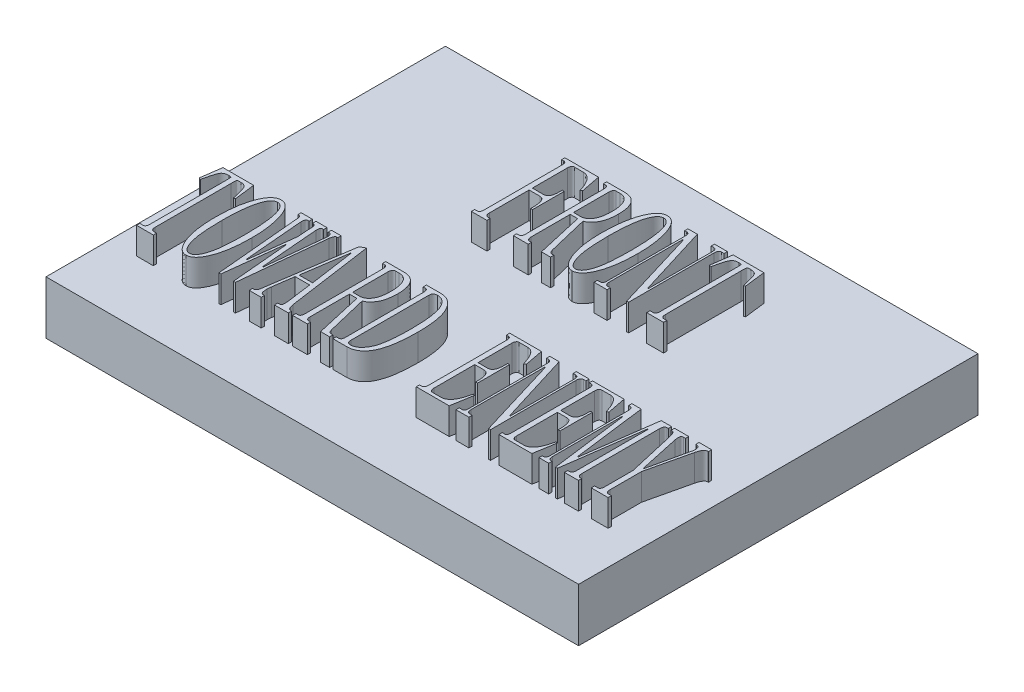
from build123d import *

# Parameters (mm, degrees)
SKETCH_1_W      = 20
SKETCH_1_H      = 15
EXTRUDE_1_DEPTH = 2
EXTRUDE_2_DEPTH = 1


with BuildPart() as part:
    # 草图1 → 凸台-拉伸1 (new body)
    with BuildSketch(Plane(origin=(0, 0, 0), x_dir=(1, 0, 0), z_dir=(0, 1, 0))):
        Rectangle(SKETCH_1_W, SKETCH_1_H)
    extrude(amount=EXTRUDE_1_DEPTH)

    # 草图4 → 凸台-拉伸2 (add)
    # profile 1 of 16: a face of its own
    with BuildSketch(Plane(origin=(0, 2, 0), x_dir=(1, 0, 0), z_dir=(0, 1, 0))):
        with BuildLine():
            Line((-2.559156639, 1.73803853), (-2.559156639, 1.615231512))
            Line((-2.559156639, 1.615231512), (-3.141352871, 1.615231512))
            Line((-3.141352871, 1.615231512), (-3.141352871, 1.73803853))
            Line((-3.141352871, 1.73803853), (-3.056449254, 1.73803853))
            add(Edge.make_bspline(
                [(-3.056449254, 1.73803853), (-3.046994589, 1.738231593), (-3.029162025, 1.738595732), (-3.005367735, 1.747700377), (-2.984741578, 1.759755254), (-2.970471525, 1.779159172), (-2.959586012, 1.802895922), (-2.952647352, 1.831467183), (-2.94791327, 1.864983541), (-2.947506993, 1.888872706), (-2.94728746, 1.90178122)],
                knots=[0, 0, 0, 0, 0.99935606, 1.88489828, 2.683966016, 3.508038545, 4.399291368, 5.457129674, 6.62595959, 8, 8, 8, 8], degree=3))
            Line((-2.94728746, 1.90178122), (-2.94728746, 4.828681805))
            add(Edge.make_bspline(
                [(-2.94728746, 4.828681805), (-2.947535354, 4.84158451), (-2.94799893, 4.865713354), (-2.952434799, 4.899302753), (-2.959753904, 4.927752419), (-2.970413453, 4.951384423), (-2.984987345, 4.970555517), (-3.004955677, 4.9838541), (-3.029373169, 4.991547583), (-3.047039574, 4.992119744), (-3.056449254, 4.992424495)],
                knots=[0, 0, 0, 0, 1.372865079, 2.567341138, 3.598284703, 4.488775163, 5.312142795, 6.125342275, 7.001498773, 8, 8, 8, 8], degree=3))
            Line((-3.056449254, 4.992424495), (-3.129223783, 4.992424495))
            Line((-3.129223783, 4.992424495), (-3.129223783, 5.115231512))
            Line((-3.129223783, 5.115231512), (-1.867798615, 5.115231512))
            Line((-1.867798615, 5.115231512), (-1.722249557, 4.378389407))
            Line((-1.722249557, 4.378389407), (-1.782894998, 4.337453734))
            add(Edge.make_bspline(
                [(-1.782894998, 4.337453734), (-1.798988223, 4.389046944), (-1.829356185, 4.486403476), (-1.885098985, 4.619959557), (-1.943913184, 4.73383481), (-2.008767556, 4.826756164), (-2.076531947, 4.900549759), (-2.149252216, 4.952655814), (-2.225265728, 4.986975582), (-2.278340654, 4.990628025), (-2.304445788, 4.992424495)],
                knots=[0, 0, 0, 0, 1.455142102, 2.745857279, 3.893844029, 4.900408233, 5.791191601, 6.576952509, 7.300067877, 8, 8, 8, 8], degree=3))
            Line((-2.304445788, 4.992424495), (-2.644060256, 4.992424495))
            add(Edge.make_bspline(
                [(-2.644060256, 4.992424495), (-2.651695298, 4.992037884), (-2.666859658, 4.991270018), (-2.688512664, 4.983569946), (-2.707299415, 4.969694998), (-2.72406801, 4.951724819), (-2.736935955, 4.927932313), (-2.74703469, 4.899651597), (-2.751664348, 4.865713911), (-2.752679691, 4.8415756), (-2.75322205, 4.828681805)],
                knots=[0, 0, 0, 0, 0.828312029, 1.645154216, 2.453170439, 3.347638751, 4.29497238, 5.372405185, 6.596435806, 8, 8, 8, 8], degree=3))
            Line((-2.75322205, 4.828681805), (-2.75322205, 3.518740284))
            Line((-2.75322205, 3.518740284), (-2.352962141, 3.518740284))
            add(Edge.make_bspline(
                [(-2.352962141, 3.518740284), (-2.333868885, 3.519853907), (-2.297883346, 3.52195278), (-2.247589753, 3.539128003), (-2.205979365, 3.568744985), (-2.174044346, 3.611662179), (-2.149596728, 3.666414438), (-2.134362747, 3.73488172), (-2.123366845, 3.816558825), (-2.122809667, 3.875741944), (-2.122509466, 3.907629173)],
                knots=[0, 0, 0, 0, 0.8912898, 1.679836316, 2.450471194, 3.242286952, 4.15179908, 5.235151676, 6.510329396, 8, 8, 8, 8], degree=3))
            Line((-2.122509466, 3.907629173), (-2.122509466, 4.009968354))
            Line((-2.122509466, 4.009968354), (-2.049734937, 4.009968354))
            Line((-2.049734937, 4.009968354), (-2.049734937, 2.822833851))
            Line((-2.049734937, 2.822833851), (-2.122509466, 2.822833851))
            Line((-2.122509466, 2.822833851), (-2.122509466, 2.904705196))
            add(Edge.make_bspline(
                [(-2.122509466, 2.904705196), (-2.1228377, 2.943151531), (-2.12345248, 3.015161114), (-2.134348693, 3.115230576), (-2.14979003, 3.200566524), (-2.173869823, 3.270453527), (-2.204467083, 3.327000221), (-2.245796568, 3.367424512), (-2.29675684, 3.392260644), (-2.333728339, 3.394676473), (-2.352962141, 3.395933267)],
                knots=[0, 0, 0, 0, 1.529325516, 2.864410685, 4.00255101, 4.972757574, 5.797380251, 6.53716377, 7.23898404, 8, 8, 8, 8], degree=3))
            Line((-2.352962141, 3.395933267), (-2.75322205, 3.395933267))
            Line((-2.75322205, 3.395933267), (-2.75322205, 1.90178122))
            add(Edge.make_bspline(
                [(-2.75322205, 1.90178122), (-2.752712669, 1.888879303), (-2.751768908, 1.864975122), (-2.746777023, 1.831144802), (-2.737135164, 1.802692351), (-2.723998994, 1.778829789), (-2.707579363, 1.760582864), (-2.688088614, 1.747965499), (-2.667064628, 1.73893021), (-2.651734014, 1.738335975), (-2.644060256, 1.73803853)],
                knots=[0, 0, 0, 0, 1.404808205, 2.602775289, 3.707143672, 4.655316944, 5.550578043, 6.343733734, 7.170953819, 8, 8, 8, 8], degree=3))
            Line((-2.644060256, 1.73803853), (-2.559156639, 1.73803853))
        make_face()
    # profile 2 of 16: a face of its own
    with BuildSketch(Plane(origin=(0, 2, 0), x_dir=(1, 0, 0), z_dir=(0, 1, 0))):
        with BuildLine():
            add(Edge.make_bspline(
                [(-0.291017155, 4.296518062), (-0.291509796, 4.263408669), (-0.292469602, 4.198902163), (-0.298274564, 4.104990089), (-0.309035152, 4.016977125), (-0.323087771, 3.934584367), (-0.342115834, 3.858162474), (-0.364655679, 3.787032283), (-0.391934457, 3.721909111), (-0.422886216, 3.662533727), (-0.457433988, 3.609775415), (-0.492148758, 3.561573602), (-0.528132063, 3.519200473), (-0.565807459, 3.48297466), (-0.604529388, 3.452671594), (-0.644055632, 3.427146277), (-0.685102935, 3.407815554), (-0.71363471, 3.399850055), (-0.727664328, 3.395933267)],
                knots=[0, 0, 0, 0, 1.48558481, 2.894341367, 4.219019729, 5.462259358, 6.64189073, 7.749766972, 8.806760094, 9.805800451, 10.749257626, 11.633645122, 12.469848182, 13.239621344, 13.97445433, 14.672692721, 15.347337659, 16, 16, 16, 16], degree=3))
            Line((-0.727664328, 3.395933267), (-0.363791684, 1.881313384))
            add(Edge.make_bspline(
                [(-0.363791684, 1.881313384), (-0.359626564, 1.868638623), (-0.351960893, 1.845311435), (-0.33944497, 1.813415093), (-0.324886405, 1.788478138), (-0.306975468, 1.763683483), (-0.279470985, 1.742949984), (-0.254440404, 1.739624695), (-0.242500802, 1.73803853)],
                knots=[0, 0, 0, 0, 1.194082335, 2.197641841, 3.058623733, 3.768607589, 4.935624439, 6, 6, 6, 6], degree=3))
            Line((-0.242500802, 1.73803853), (-0.169726273, 1.73803853))
            Line((-0.169726273, 1.73803853), (-0.169726273, 1.615231512))
            Line((-0.169726273, 1.615231512), (-0.509340742, 1.615231512))
            Line((-0.509340742, 1.615231512), (-0.909600651, 3.37546543))
            Line((-0.909600651, 3.37546543), (-1.188569678, 3.37546543))
            Line((-1.188569678, 3.37546543), (-1.188569678, 1.90178122))
            add(Edge.make_bspline(
                [(-1.188569678, 1.90178122), (-1.188060297, 1.888879303), (-1.187116536, 1.864975122), (-1.182124651, 1.831144802), (-1.172482792, 1.802692351), (-1.159346622, 1.778829789), (-1.142926991, 1.760582864), (-1.123436242, 1.747965499), (-1.102412256, 1.73893021), (-1.087081643, 1.738335975), (-1.079407885, 1.73803853)],
                knots=[0, 0, 0, 0, 1.404808205, 2.602775289, 3.707143672, 4.655316944, 5.550578043, 6.343733734, 7.170953819, 8, 8, 8, 8], degree=3))
            Line((-1.079407885, 1.73803853), (-1.006633356, 1.73803853))
            Line((-1.006633356, 1.73803853), (-1.006633356, 1.615231512))
            Line((-1.006633356, 1.615231512), (-1.564571411, 1.615231512))
            Line((-1.564571411, 1.615231512), (-1.564571411, 1.73803853))
            Line((-1.564571411, 1.73803853), (-1.491796882, 1.73803853))
            add(Edge.make_bspline(
                [(-1.491796882, 1.73803853), (-1.482342217, 1.738231593), (-1.464509653, 1.738595732), (-1.440715363, 1.747700377), (-1.420089206, 1.759755254), (-1.405819154, 1.779159172), (-1.394933641, 1.802895922), (-1.38799498, 1.831467183), (-1.383260899, 1.864983541), (-1.382854621, 1.888872706), (-1.382635089, 1.90178122)],
                knots=[0, 0, 0, 0, 0.99935606, 1.88489828, 2.683966016, 3.508038545, 4.399291368, 5.457129674, 6.62595959, 8, 8, 8, 8], degree=3))
            Line((-1.382635089, 1.90178122), (-1.382635089, 4.828681805))
            add(Edge.make_bspline(
                [(-1.382635089, 4.828681805), (-1.382882982, 4.84158451), (-1.383346559, 4.865713354), (-1.387782427, 4.899302753), (-1.395101532, 4.927752419), (-1.405761082, 4.951384423), (-1.420334973, 4.970555517), (-1.440303305, 4.9838541), (-1.464720797, 4.991547583), (-1.482387203, 4.992119744), (-1.491796882, 4.992424495)],
                knots=[0, 0, 0, 0, 1.372865079, 2.567341138, 3.598284703, 4.488775163, 5.312142795, 6.125342275, 7.001498773, 8, 8, 8, 8], degree=3))
            Line((-1.491796882, 4.992424495), (-1.564571411, 4.992424495))
            Line((-1.564571411, 4.992424495), (-1.564571411, 5.115231512))
            Line((-1.564571411, 5.115231512), (-0.873213386, 5.115231512))
            add(Edge.make_bspline(
                [(-0.873213386, 5.115231512), (-0.850688209, 5.114724834), (-0.806422019, 5.113729117), (-0.742338917, 5.103739242), (-0.682194551, 5.087507569), (-0.625796963, 5.065977085), (-0.573623445, 5.036352954), (-0.525060507, 5.001201326), (-0.481636008, 4.958316971), (-0.440913575, 4.910687415), (-0.405588788, 4.855632514), (-0.374262296, 4.794838736), (-0.348631922, 4.72734579), (-0.327476471, 4.653536627), (-0.311100463, 4.573164216), (-0.298892292, 4.486608124), (-0.292263902, 4.393655774), (-0.291442146, 4.329630366), (-0.291017155, 4.296518062)],
                knots=[0, 0, 0, 0, 0.94896745, 1.864898642, 2.725324363, 3.571924948, 4.401672371, 5.247468458, 6.091182706, 6.96813084, 7.884000093, 8.841537346, 9.846426432, 10.9218366, 12.074989596, 13.301196734, 14.604247952, 16, 16, 16, 16], degree=3))
        make_face()
        with BuildLine():
            Line((-1.188569678, 3.498272448), (-0.921729739, 3.498272448))
            add(Edge.make_bspline(
                [(-0.921729739, 3.498272448), (-0.906781463, 3.498892127), (-0.87740698, 3.500109842), (-0.834246888, 3.508689699), (-0.793021267, 3.523009643), (-0.754146771, 3.544130314), (-0.716537369, 3.569775196), (-0.681840063, 3.602324745), (-0.648067175, 3.639466208), (-0.617213952, 3.683173112), (-0.587976395, 3.732137496), (-0.56418118, 3.788502692), (-0.542481207, 3.850594201), (-0.52683714, 3.91965839), (-0.512412847, 3.994364325), (-0.504276775, 4.075790462), (-0.49753896, 4.163491025), (-0.497323074, 4.224233034), (-0.497211653, 4.255582389)],
                knots=[0, 0, 0, 0, 0.743825915, 1.461673706, 2.181722139, 2.907570008, 3.657749904, 4.441250537, 5.269608784, 6.152784153, 7.09984246, 8.102408331, 9.192305742, 10.369910222, 11.623208299, 12.977528658, 14.440082405, 16, 16, 16, 16], degree=3))
            add(Edge.make_bspline(
                [(-0.497211653, 4.255582389), (-0.497401207, 4.283895289), (-0.497768833, 4.338806212), (-0.503502853, 4.418701253), (-0.511269692, 4.493697739), (-0.523744423, 4.563711725), (-0.53846205, 4.629221833), (-0.557702715, 4.689862029), (-0.579156112, 4.74625673), (-0.605267719, 4.797005936), (-0.633558689, 4.843369959), (-0.66761511, 4.882551364), (-0.703718121, 4.917746594), (-0.745282184, 4.944701705), (-0.789949214, 4.966634683), (-0.838603492, 4.981374584), (-0.891035843, 4.990895322), (-0.927244184, 4.991902906), (-0.945987915, 4.992424495)],
                knots=[0, 0, 0, 0, 1.398678352, 2.71264051, 3.956382251, 5.122356182, 6.224825504, 7.271360517, 8.263758874, 9.201887895, 10.088672485, 10.93920239, 11.760734213, 12.571088212, 13.375262109, 14.212490119, 15.074671662, 16, 16, 16, 16], degree=3))
            Line((-0.945987915, 4.992424495), (-1.079407885, 4.992424495))
            add(Edge.make_bspline(
                [(-1.079407885, 4.992424495), (-1.087042927, 4.992037884), (-1.102207286, 4.991270018), (-1.123860292, 4.983569946), (-1.142647043, 4.969694998), (-1.159415639, 4.951724819), (-1.172283583, 4.927932313), (-1.182382319, 4.899651597), (-1.187011977, 4.865713911), (-1.188027319, 4.8415756), (-1.188569678, 4.828681805)],
                knots=[0, 0, 0, 0, 0.828312029, 1.645154216, 2.453170439, 3.347638751, 4.29497238, 5.372405185, 6.596435806, 8, 8, 8, 8], degree=3))
            Line((-1.188569678, 4.828681805), (-1.188569678, 3.498272448))
        make_face(mode=Mode.SUBTRACT)
    # profile 3 of 16: a face of its own
    with BuildSketch(Plane(origin=(0, 2, 0), x_dir=(1, 0, 0), z_dir=(0, 1, 0))):
        with BuildLine():
            add(Edge.make_bspline(
                [(1.358538834, 3.37546543), (1.357986956, 3.307481408), (1.356911402, 3.174987378), (1.347711325, 2.981811051), (1.332813507, 2.799725592), (1.311792209, 2.628970478), (1.284619537, 2.469311676), (1.251548632, 2.320691105), (1.212398045, 2.183098771), (1.167058507, 2.057573883), (1.117847369, 1.945096847), (1.064589912, 1.847186955), (1.008957174, 1.763750097), (0.949417521, 1.695405257), (0.887367689, 1.640845596), (0.820710014, 1.603109527), (0.7512412, 1.578580462), (0.703258462, 1.575722347), (0.679309897, 1.57429584)],
                knots=[0, 0, 0, 0, 1.579167263, 3.077638365, 4.491288179, 5.822194297, 7.072846744, 8.251973179, 9.357394471, 10.393487356, 11.350058664, 12.206414908, 12.979745472, 13.674400847, 14.307257928, 14.888255607, 15.44511955, 16, 16, 16, 16], degree=3))
            add(Edge.make_bspline(
                [(0.679309897, 1.57429584), (0.656349262, 1.575684296), (0.609970535, 1.578488871), (0.542910955, 1.604174353), (0.477934425, 1.642688955), (0.416505467, 1.697791308), (0.357855502, 1.768000812), (0.302424579, 1.853477331), (0.248424452, 1.953592201), (0.197606382, 2.06814935), (0.150805772, 2.195396705), (0.111198809, 2.334204575), (0.076034746, 2.482568453), (0.048520336, 2.641612783), (0.026334688, 2.810527441), (0.012002584, 2.98992786), (0.001424131, 3.179252634), (0.000536004, 3.308991929), (8.0961e-05, 3.37546543)],
                knots=[0, 0, 0, 0, 0.533535653, 1.077701192, 1.653664199, 2.288297637, 2.990647592, 3.78157006, 4.659485261, 5.640590947, 6.701217591, 7.818089219, 9.00428271, 10.254840937, 11.579801637, 12.975277943, 14.450246976, 16, 16, 16, 16], degree=3))
            add(Edge.make_bspline(
                [(8.0961e-05, 3.37546543), (0.000610003, 3.440419453), (0.001641873, 3.567108943), (0.011203257, 3.752408186), (0.025069572, 3.928202485), (0.045455692, 4.09439086), (0.071807508, 4.251024771), (0.104432711, 4.397959652), (0.141858114, 4.535625723), (0.185780612, 4.662332812), (0.233149339, 4.777458593), (0.286304303, 4.877317916), (0.341260395, 4.963260218), (0.401439188, 5.032723421), (0.464885722, 5.088370633), (0.532860597, 5.127437949), (0.604889303, 5.152006323), (0.654356015, 5.154772011), (0.679309897, 5.156167185)],
                knots=[0, 0, 0, 0, 1.521622669, 2.967846978, 4.345883694, 5.652178311, 6.889173724, 8.065525795, 9.177177049, 10.229338327, 11.205688713, 12.090207897, 12.876698621, 13.590100857, 14.236709451, 14.843963471, 15.416828027, 16, 16, 16, 16], degree=3))
            add(Edge.make_bspline(
                [(0.679309897, 5.156167185), (0.705017982, 5.15451723), (0.756331833, 5.151223886), (0.830821839, 5.125736411), (0.900044748, 5.083336355), (0.96526433, 5.025400481), (1.025058295, 4.950275905), (1.08093399, 4.859543487), (1.132004713, 4.752508574), (1.179014624, 4.631536517), (1.220632675, 4.498878052), (1.257818309, 4.358277314), (1.288593567, 4.210679092), (1.314598695, 4.056725828), (1.333867292, 3.895794614), (1.34841275, 3.728442065), (1.356669806, 3.554200155), (1.35790722, 3.435866548), (1.358538834, 3.37546543)],
                knots=[0, 0, 0, 0, 0.602120347, 1.201844244, 1.823877121, 2.495697139, 3.237107323, 4.067606002, 4.990016644, 6.014640194, 7.109238994, 8.249185918, 9.424331202, 10.644177132, 11.910017719, 13.224615075, 14.583358067, 16, 16, 16, 16], degree=3))
        make_face()
        with BuildLine():
            add(Edge.make_bspline(
                [(0.230533636, 3.37546543), (0.230997256, 3.304707917), (0.231893215, 3.167967105), (0.237959127, 2.970312139), (0.247615815, 2.787806819), (0.260916537, 2.620136266), (0.278926617, 2.46765636), (0.300645779, 2.330019005), (0.326125226, 2.207456519), (0.355542532, 2.099626912), (0.387936711, 2.005223957), (0.424055731, 1.924475056), (0.459047072, 1.85431173), (0.499451075, 1.798618655), (0.53979691, 1.752865919), (0.584456107, 1.721738096), (0.630737095, 1.700290819), (0.663167443, 1.698162329), (0.679309897, 1.697102857)],
                knots=[0, 0, 0, 0, 1.851882593, 3.57881331, 5.174980784, 6.634809691, 7.980130114, 9.19243835, 10.280693583, 11.254584253, 12.116319301, 12.889220616, 13.569638818, 14.162385832, 14.686481191, 15.156225013, 15.580004533, 16, 16, 16, 16], degree=3))
            add(Edge.make_bspline(
                [(0.679309897, 1.697102857), (0.696132231, 1.698333704), (0.729924681, 1.700806211), (0.778930879, 1.71922849), (0.824505684, 1.750026142), (0.866971929, 1.792488852), (0.906476314, 1.846693881), (0.94335614, 1.912151972), (0.977191089, 1.989543719), (1.009219771, 2.079079256), (1.038402972, 2.183274439), (1.061461304, 2.304117186), (1.083120032, 2.441313427), (1.098752521, 2.595486006), (1.112968427, 2.766286785), (1.121043427, 2.95417603), (1.127794275, 3.159114452), (1.127986263, 3.30142042), (1.128086159, 3.37546543)],
                knots=[0, 0, 0, 0, 0.437442244, 0.878727392, 1.344079226, 1.860537441, 2.434297933, 3.085560534, 3.813092001, 4.631021719, 5.560142477, 6.627300512, 7.832401615, 9.175912405, 10.66108668, 12.294774539, 14.07208748, 16, 16, 16, 16], degree=3))
            add(Edge.make_bspline(
                [(1.128086159, 3.37546543), (1.127790361, 3.435354904), (1.127213653, 3.552119662), (1.122871223, 3.722996223), (1.114406049, 3.88499508), (1.103272285, 4.037936073), (1.088787025, 4.181756865), (1.071760328, 4.31685861), (1.050468724, 4.442983599), (1.026844416, 4.559546286), (0.999126051, 4.664433503), (0.968346364, 4.75695256), (0.930788983, 4.834690135), (0.890828505, 4.899725966), (0.844183838, 4.949317608), (0.794315185, 4.98672617), (0.738175293, 5.009155831), (0.698954617, 5.011645376), (0.679309897, 5.012892331)],
                knots=[0, 0, 0, 0, 1.591570283, 3.103038055, 4.541998199, 5.902212945, 7.177791806, 8.383043078, 9.520142869, 10.576381044, 11.542303489, 12.40240583, 13.16229771, 13.832881649, 14.421989135, 14.960634021, 15.479405892, 16, 16, 16, 16], degree=3))
            add(Edge.make_bspline(
                [(0.679309897, 5.012892331), (0.662426111, 5.011837559), (0.628234137, 5.009701501), (0.57955342, 4.988124036), (0.533841288, 4.95525393), (0.491228235, 4.909495379), (0.452082788, 4.850777351), (0.415180632, 4.780065048), (0.381293966, 4.696409217), (0.349615031, 4.600505193), (0.321992683, 4.491224015), (0.296850003, 4.369645343), (0.277193775, 4.234889301), (0.259253764, 4.087853393), (0.247278138, 3.927703084), (0.236913937, 3.755123748), (0.232188915, 3.569555932), (0.231098265, 3.441671322), (0.230533636, 3.37546543)],
                knots=[0, 0, 0, 0, 0.448843603, 0.908969593, 1.397910813, 1.94709051, 2.56879189, 3.27847594, 4.074607825, 4.977686291, 5.974907196, 7.084455459, 8.293248964, 9.612163148, 11.041291968, 12.583076035, 14.231057707, 16, 16, 16, 16], degree=3))
        make_face(mode=Mode.SUBTRACT)
    # profile 4 of 16: a face of its own
    with BuildSketch(Plane(origin=(0, 2, 0), x_dir=(1, 0, 0), z_dir=(0, 1, 0))):
        with BuildLine():
            Line((2.668480354, 2.433944962), (2.692738531, 2.433944962))
            Line((2.692738531, 2.433944962), (2.692738531, 4.828681805))
            add(Edge.make_bspline(
                [(2.692738531, 4.828681805), (2.692490637, 4.84158451), (2.692027061, 4.865713354), (2.687591192, 4.899302753), (2.680272087, 4.927752419), (2.669612538, 4.951384423), (2.655038646, 4.970555517), (2.635070314, 4.9838541), (2.610652822, 4.991547583), (2.592986417, 4.992119744), (2.583576737, 4.992424495)],
                knots=[0, 0, 0, 0, 1.372865079, 2.567341138, 3.598284703, 4.488775163, 5.312142795, 6.125342275, 7.001498773, 8, 8, 8, 8], degree=3))
            Line((2.583576737, 4.992424495), (2.486544032, 4.992424495))
            Line((2.486544032, 4.992424495), (2.486544032, 5.115231512))
            Line((2.486544032, 5.115231512), (2.971707558, 5.115231512))
            Line((2.971707558, 5.115231512), (2.971707558, 4.992424495))
            Line((2.971707558, 4.992424495), (2.874674853, 4.992424495))
            add(Edge.make_bspline(
                [(2.874674853, 4.992424495), (2.867039811, 4.992037884), (2.851875451, 4.991270018), (2.830222446, 4.983569946), (2.811435694, 4.969694998), (2.794667099, 4.951724819), (2.781799155, 4.927932313), (2.771700419, 4.899651597), (2.767070761, 4.865713911), (2.766055418, 4.8415756), (2.76551306, 4.828681805)],
                knots=[0, 0, 0, 0, 0.828312029, 1.645154216, 2.453170439, 3.347638751, 4.29497238, 5.372405185, 6.596435806, 8, 8, 8, 8], degree=3))
            Line((2.76551306, 4.828681805), (2.76551306, 1.615231512))
            Line((2.76551306, 1.615231512), (2.692738531, 1.615231512))
            Line((2.692738531, 1.615231512), (1.770927831, 4.664939115))
            Line((1.770927831, 4.664939115), (1.746669655, 4.664939115))
            Line((1.746669655, 4.664939115), (1.746669655, 1.90178122))
            add(Edge.make_bspline(
                [(1.746669655, 1.90178122), (1.747179035, 1.888879303), (1.748122796, 1.864975122), (1.753114682, 1.831144802), (1.762756541, 1.802692351), (1.775892711, 1.778829789), (1.792312342, 1.760582864), (1.811803091, 1.747965499), (1.832827077, 1.73893021), (1.84815769, 1.738335975), (1.855831448, 1.73803853)],
                knots=[0, 0, 0, 0, 1.404808205, 2.602775289, 3.707143672, 4.655316944, 5.550578043, 6.343733734, 7.170953819, 8, 8, 8, 8], degree=3))
            Line((1.855831448, 1.73803853), (1.952864153, 1.73803853))
            Line((1.952864153, 1.73803853), (1.952864153, 1.615231512))
            Line((1.952864153, 1.615231512), (1.467700627, 1.615231512))
            Line((1.467700627, 1.615231512), (1.467700627, 1.73803853))
            Line((1.467700627, 1.73803853), (1.564733333, 1.73803853))
            add(Edge.make_bspline(
                [(1.564733333, 1.73803853), (1.574187997, 1.738231593), (1.592020562, 1.738595732), (1.615814851, 1.747700377), (1.636441008, 1.759755254), (1.650711061, 1.779159172), (1.661596574, 1.802895922), (1.668535234, 1.831467183), (1.673269316, 1.864983541), (1.673675594, 1.888872706), (1.673895126, 1.90178122)],
                knots=[0, 0, 0, 0, 0.99935606, 1.88489828, 2.683966016, 3.508038545, 4.399291368, 5.457129674, 6.62595959, 8, 8, 8, 8], degree=3))
            Line((1.673895126, 1.90178122), (1.673895126, 4.828681805))
            add(Edge.make_bspline(
                [(1.673895126, 4.828681805), (1.673647232, 4.84158451), (1.673183656, 4.865713354), (1.668747787, 4.899302753), (1.661428682, 4.927752419), (1.650769133, 4.951384423), (1.636195241, 4.970555517), (1.616226909, 4.9838541), (1.591809418, 4.991547583), (1.574143012, 4.992119744), (1.564733333, 4.992424495)],
                knots=[0, 0, 0, 0, 1.372865079, 2.567341138, 3.598284703, 4.488775163, 5.312142795, 6.125342275, 7.001498773, 8, 8, 8, 8], degree=3))
            Line((1.564733333, 4.992424495), (1.491958804, 4.992424495))
            Line((1.491958804, 4.992424495), (1.491958804, 5.115231512))
            Line((1.491958804, 5.115231512), (1.84370236, 5.115231512))
            Line((1.84370236, 5.115231512), (2.668480354, 2.433944962))
        make_face()
    # profile 5 of 16: a face of its own
    with BuildSketch(Plane(origin=(0, 2, 0), x_dir=(1, 0, 0), z_dir=(0, 1, 0))):
        with BuildLine():
            Line((4.07545458, 1.615231512), (3.444741996, 1.615231512))
            Line((3.444741996, 1.615231512), (3.444741996, 1.73803853))
            Line((3.444741996, 1.73803853), (3.55390379, 1.73803853))
            add(Edge.make_bspline(
                [(3.55390379, 1.73803853), (3.563358454, 1.738231593), (3.581191019, 1.738595732), (3.604985308, 1.747700377), (3.625611465, 1.759755254), (3.639881518, 1.779159172), (3.650767031, 1.802895922), (3.657705691, 1.831467183), (3.662439773, 1.864983541), (3.662846051, 1.888872706), (3.663065583, 1.90178122)],
                knots=[0, 0, 0, 0, 0.99935606, 1.88489828, 2.683966016, 3.508038545, 4.399291368, 5.457129674, 6.62595959, 8, 8, 8, 8], degree=3))
            Line((3.663065583, 1.90178122), (3.663065583, 4.767278296))
            add(Edge.make_bspline(
                [(3.663065583, 4.767278296), (3.662921339, 4.791497398), (3.662667322, 4.834147655), (3.661036447, 4.889692693), (3.657124728, 4.926201282), (3.653877954, 4.951005086), (3.638750966, 4.962853084), (3.617867966, 4.967534263), (3.58891255, 4.971276299), (3.566560891, 4.971710681), (3.55390379, 4.971956658)],
                knots=[0, 0, 0, 0, 2.030286132, 3.575368864, 4.616985369, 5.166010725, 5.555954429, 6.131233156, 6.941771103, 8, 8, 8, 8], degree=3))
            add(Edge.make_bspline(
                [(3.55390379, 4.971956658), (3.527728509, 4.971104812), (3.478547108, 4.969504255), (3.411123397, 4.949694455), (3.355884274, 4.917049159), (3.320464662, 4.877324886), (3.297797721, 4.836013764), (3.281090117, 4.793304609), (3.26092821, 4.740882186), (3.242130693, 4.67669087), (3.2201493, 4.602480668), (3.20008772, 4.516556307), (3.1756867, 4.420676426), (3.161230394, 4.352673239), (3.15364388, 4.316985898)],
                knots=[0, 0, 0, 0, 1.110002274, 2.085611602, 2.953513968, 3.805644127, 4.310743409, 4.951273188, 5.753582802, 6.698353765, 7.793435623, 9.044265751, 10.448862456, 12, 12, 12, 12], degree=3))
            Line((3.15364388, 4.316985898), (3.080869352, 4.337453734))
            Line((3.080869352, 4.337453734), (3.190031145, 5.115231512))
            Line((3.190031145, 5.115231512), (4.342294519, 5.115231512))
            Line((4.342294519, 5.115231512), (4.439327225, 4.337453734))
            Line((4.439327225, 4.337453734), (4.378681784, 4.316985898))
            add(Edge.make_bspline(
                [(4.378681784, 4.316985898), (4.370879877, 4.351105784), (4.356014731, 4.416115155), (4.334321965, 4.508740074), (4.31292347, 4.591270708), (4.293388599, 4.664104413), (4.275094233, 4.72699721), (4.25909662, 4.780157085), (4.242688556, 4.822909609), (4.224974215, 4.866639373), (4.195494456, 4.911170813), (4.143361994, 4.94759763), (4.07731588, 4.969224759), (4.028893675, 4.97099716), (4.002680051, 4.971956658)],
                knots=[0, 0, 0, 0, 1.519790558, 2.895690489, 4.130483376, 5.221756792, 6.169752624, 6.974841911, 7.631064222, 8.156926501, 9.024350694, 9.904450753, 10.865563021, 12, 12, 12, 12], degree=3))
            add(Edge.make_bspline(
                [(4.002680051, 4.971956658), (3.984732277, 4.971741527), (3.953332718, 4.971365156), (3.912941933, 4.967444915), (3.885591261, 4.963472616), (3.865701818, 4.95169972), (3.863418041, 4.923522406), (3.858956833, 4.883823169), (3.857599724, 4.821680405), (3.857301411, 4.774031123), (3.857130993, 4.74681046)],
                knots=[0, 0, 0, 0, 1.2566947, 2.19858239, 2.833804574, 3.201970123, 3.695472213, 4.654976038, 6.089084119, 8, 8, 8, 8], degree=3))
            Line((3.857130993, 4.74681046), (3.857130993, 1.90178122))
            add(Edge.make_bspline(
                [(3.857130993, 1.90178122), (3.857640374, 1.888879303), (3.858584135, 1.864975122), (3.863576021, 1.831144802), (3.873217879, 1.802692351), (3.88635405, 1.778829789), (3.90277368, 1.760582864), (3.922264429, 1.747965499), (3.943288415, 1.73893021), (3.958619029, 1.738335975), (3.966292787, 1.73803853)],
                knots=[0, 0, 0, 0, 1.404808205, 2.602775289, 3.707143672, 4.655316944, 5.550578043, 6.343733734, 7.170953819, 8, 8, 8, 8], degree=3))
            Line((3.966292787, 1.73803853), (4.07545458, 1.73803853))
            Line((4.07545458, 1.73803853), (4.07545458, 1.615231512))
        make_face()
    # profile 6 of 16: a face of its own
    with BuildSketch(Plane(origin=(0, 2, 0), x_dir=(1, 0, 0), z_dir=(0, 1, 0))):
        with BuildLine():
            Line((-8.344731688, -5.12453457), (-8.975444272, -5.12453457))
            Line((-8.975444272, -5.12453457), (-8.975444272, -5.001727552))
            Line((-8.975444272, -5.001727552), (-8.866282479, -5.001727552))
            add(Edge.make_bspline(
                [(-8.866282479, -5.001727552), (-8.856827814, -5.001534489), (-8.83899525, -5.00117035), (-8.81520096, -4.992065705), (-8.794574803, -4.980010828), (-8.78030475, -4.96060691), (-8.769419237, -4.93687016), (-8.762480577, -4.908298899), (-8.757746495, -4.874782541), (-8.757340218, -4.850893376), (-8.757120685, -4.837984862)],
                knots=[0, 0, 0, 0, 0.99935606, 1.88489828, 2.683966016, 3.508038545, 4.399291368, 5.457129674, 6.62595959, 8, 8, 8, 8], degree=3))
            Line((-8.757120685, -4.837984862), (-8.757120685, -1.972487786))
            add(Edge.make_bspline(
                [(-8.757120685, -1.972487786), (-8.757264929, -1.948268684), (-8.757518946, -1.905618427), (-8.759149821, -1.850073389), (-8.76306154, -1.8135648), (-8.766308314, -1.788760996), (-8.781435302, -1.776912998), (-8.802318302, -1.772231819), (-8.831273718, -1.768489783), (-8.853625377, -1.768055401), (-8.866282479, -1.767809424)],
                knots=[0, 0, 0, 0, 2.030286132, 3.575368864, 4.616985369, 5.166010725, 5.555954429, 6.131233156, 6.941771103, 8, 8, 8, 8], degree=3))
            add(Edge.make_bspline(
                [(-8.866282479, -1.767809424), (-8.892457759, -1.76866127), (-8.94163916, -1.770261827), (-9.009062871, -1.790071626), (-9.064301995, -1.822716922), (-9.099721606, -1.862441196), (-9.122388547, -1.903752317), (-9.139096151, -1.946461473), (-9.159258059, -1.998883896), (-9.178055575, -2.063075212), (-9.200036968, -2.137285414), (-9.220098549, -2.223209774), (-9.244499568, -2.319089656), (-9.258955874, -2.387092843), (-9.266542388, -2.422780184)],
                knots=[0, 0, 0, 0, 1.110002274, 2.085611602, 2.953513968, 3.805644127, 4.310743409, 4.951273188, 5.753582802, 6.698353765, 7.793435623, 9.044265751, 10.448862456, 12, 12, 12, 12], degree=3))
            Line((-9.266542388, -2.422780184), (-9.339316917, -2.402312347))
            Line((-9.339316917, -2.402312347), (-9.230155123, -1.62453457))
            Line((-9.230155123, -1.62453457), (-8.077891749, -1.62453457))
            Line((-8.077891749, -1.62453457), (-7.980859043, -2.402312347))
            Line((-7.980859043, -2.402312347), (-8.041504484, -2.422780184))
            add(Edge.make_bspline(
                [(-8.041504484, -2.422780184), (-8.049306392, -2.388660298), (-8.064171538, -2.323650927), (-8.085864304, -2.231026008), (-8.107262798, -2.148495374), (-8.126797669, -2.075661669), (-8.145092035, -2.012768872), (-8.161089648, -1.959608997), (-8.177497712, -1.916856472), (-8.195212053, -1.873126709), (-8.224691812, -1.828595269), (-8.276824274, -1.792168452), (-8.342870389, -1.770541323), (-8.391292593, -1.768768922), (-8.417506217, -1.767809424)],
                knots=[0, 0, 0, 0, 1.519790558, 2.895690489, 4.130483376, 5.221756792, 6.169752624, 6.974841911, 7.631064222, 8.156926501, 9.024350694, 9.904450753, 10.865563021, 12, 12, 12, 12], degree=3))
            add(Edge.make_bspline(
                [(-8.417506217, -1.767809424), (-8.435453991, -1.768024555), (-8.46685355, -1.768400926), (-8.507244335, -1.772321167), (-8.534595007, -1.776293466), (-8.55448445, -1.788066362), (-8.556768227, -1.816243676), (-8.561229435, -1.855942913), (-8.562586545, -1.918085677), (-8.562884857, -1.965734959), (-8.563055275, -1.992955622)],
                knots=[0, 0, 0, 0, 1.2566947, 2.19858239, 2.833804574, 3.201970123, 3.695472213, 4.654976038, 6.089084119, 8, 8, 8, 8], degree=3))
            Line((-8.563055275, -1.992955622), (-8.563055275, -4.837984862))
            add(Edge.make_bspline(
                [(-8.563055275, -4.837984862), (-8.562545894, -4.850886779), (-8.561602133, -4.87479096), (-8.556610248, -4.90862128), (-8.546968389, -4.937073731), (-8.533832219, -4.960936292), (-8.517412588, -4.979183217), (-8.497921839, -4.991800583), (-8.476897853, -5.000835872), (-8.461567239, -5.001430107), (-8.453893481, -5.001727552)],
                knots=[0, 0, 0, 0, 1.404808205, 2.602775289, 3.707143672, 4.655316944, 5.550578043, 6.343733734, 7.170953819, 8, 8, 8, 8], degree=3))
            Line((-8.453893481, -5.001727552), (-8.344731688, -5.001727552))
            Line((-8.344731688, -5.001727552), (-8.344731688, -5.12453457))
        make_face()
    # profile 7 of 16: a face of its own
    with BuildSketch(Plane(origin=(0, 2, 0), x_dir=(1, 0, 0), z_dir=(0, 1, 0))):
        with BuildLine():
            add(Edge.make_bspline(
                [(-6.404077584, -3.364300652), (-6.404629461, -3.432284674), (-6.405705015, -3.564778704), (-6.414905092, -3.757955031), (-6.42980291, -3.94004049), (-6.450824208, -4.110795604), (-6.47799688, -4.270454406), (-6.511067785, -4.419074977), (-6.550218373, -4.556667311), (-6.59555791, -4.682192199), (-6.644769049, -4.794669235), (-6.698026506, -4.892579126), (-6.753659243, -4.976015985), (-6.813198896, -5.044360825), (-6.875248729, -5.098920486), (-6.941906403, -5.136656555), (-7.011375218, -5.16118562), (-7.059357955, -5.164043734), (-7.08330652, -5.165470242)],
                knots=[0, 0, 0, 0, 1.579167263, 3.077638365, 4.491288179, 5.822194297, 7.072846744, 8.251973179, 9.357394471, 10.393487356, 11.350058664, 12.206414908, 12.979745472, 13.674400847, 14.307257928, 14.888255607, 15.44511955, 16, 16, 16, 16], degree=3))
            add(Edge.make_bspline(
                [(-7.08330652, -5.165470242), (-7.106267156, -5.164081786), (-7.152645882, -5.161277211), (-7.219705463, -5.135591729), (-7.284681992, -5.097077127), (-7.34611095, -5.041974774), (-7.404760916, -4.97176527), (-7.460191838, -4.886288751), (-7.514191966, -4.786173881), (-7.565010035, -4.671616732), (-7.611810645, -4.544369377), (-7.651417609, -4.405561507), (-7.686581671, -4.257197629), (-7.714096082, -4.098153299), (-7.736281729, -3.929238641), (-7.750613834, -3.749838222), (-7.761192286, -3.560513447), (-7.762080414, -3.430774153), (-7.762535457, -3.364300652)],
                knots=[0, 0, 0, 0, 0.533535653, 1.077701192, 1.653664199, 2.288297637, 2.990647592, 3.78157006, 4.659485261, 5.640590947, 6.701217591, 7.818089219, 9.00428271, 10.254840937, 11.579801637, 12.975277943, 14.450246976, 16, 16, 16, 16], degree=3))
            add(Edge.make_bspline(
                [(-7.762535457, -3.364300652), (-7.762006414, -3.299346629), (-7.760974545, -3.172657139), (-7.75141316, -2.987357896), (-7.737546846, -2.811563597), (-7.717160726, -2.645375222), (-7.69080891, -2.488741311), (-7.658183706, -2.34180643), (-7.620758304, -2.204140358), (-7.576835806, -2.077433269), (-7.529467078, -1.962307489), (-7.476312114, -1.862448166), (-7.421356023, -1.776505864), (-7.361177229, -1.707042661), (-7.297730696, -1.651395449), (-7.22975582, -1.612328133), (-7.157727115, -1.587759759), (-7.108260403, -1.584994071), (-7.08330652, -1.583598897)],
                knots=[0, 0, 0, 0, 1.521622669, 2.967846978, 4.345883694, 5.652178311, 6.889173724, 8.065525795, 9.177177049, 10.229338327, 11.205688713, 12.090207897, 12.876698621, 13.590100857, 14.236709451, 14.843963471, 15.416828027, 16, 16, 16, 16], degree=3))
            add(Edge.make_bspline(
                [(-7.08330652, -1.583598897), (-7.057598435, -1.585248852), (-7.006284585, -1.588542195), (-6.931794579, -1.614029671), (-6.86257167, -1.656429727), (-6.797352087, -1.714365601), (-6.737558122, -1.789490177), (-6.681682428, -1.880222595), (-6.630611704, -1.987257507), (-6.583601793, -2.108229565), (-6.541983742, -2.24088803), (-6.504798108, -2.381488768), (-6.474022851, -2.52908699), (-6.448017723, -2.683040254), (-6.428749126, -2.843971468), (-6.414203668, -3.011324017), (-6.405946612, -3.185565927), (-6.404709198, -3.303899534), (-6.404077584, -3.364300652)],
                knots=[0, 0, 0, 0, 0.602120347, 1.201844244, 1.823877121, 2.495697139, 3.237107323, 4.067606002, 4.990016644, 6.014640194, 7.109238994, 8.249185918, 9.424331202, 10.644177132, 11.910017719, 13.224615075, 14.583358067, 16, 16, 16, 16], degree=3))
        make_face()
        with BuildLine():
            add(Edge.make_bspline(
                [(-7.532082782, -3.364300652), (-7.531619162, -3.435058165), (-7.530723203, -3.571798977), (-7.524657291, -3.769453943), (-7.515000602, -3.951959263), (-7.50169988, -4.119629816), (-7.483689801, -4.272109722), (-7.461970638, -4.409747077), (-7.436491192, -4.532309563), (-7.407073886, -4.64013917), (-7.374679707, -4.734542125), (-7.338560686, -4.815291026), (-7.303569346, -4.885454352), (-7.263165343, -4.941147427), (-7.222819507, -4.986900163), (-7.178160311, -5.018027986), (-7.131879323, -5.039475263), (-7.099448975, -5.041603753), (-7.08330652, -5.042663225)],
                knots=[0, 0, 0, 0, 1.851882593, 3.57881331, 5.174980784, 6.634809691, 7.980130114, 9.19243835, 10.280693583, 11.254584253, 12.116319301, 12.889220616, 13.569638818, 14.162385832, 14.686481191, 15.156225013, 15.580004533, 16, 16, 16, 16], degree=3))
            add(Edge.make_bspline(
                [(-7.08330652, -5.042663225), (-7.066484187, -5.041432378), (-7.032691736, -5.03895987), (-6.983685539, -5.020537591), (-6.938110733, -4.98973994), (-6.895644488, -4.94727723), (-6.856140103, -4.893072201), (-6.819260278, -4.82761411), (-6.785425329, -4.750222363), (-6.753396647, -4.660686826), (-6.724213446, -4.556491643), (-6.701155114, -4.435648896), (-6.679496386, -4.298452654), (-6.663863896, -4.144280075), (-6.64964799, -3.973479297), (-6.64157299, -3.785590052), (-6.634822142, -3.580651629), (-6.634630154, -3.438345662), (-6.634530259, -3.364300652)],
                knots=[0, 0, 0, 0, 0.437442244, 0.878727392, 1.344079226, 1.860537441, 2.434297933, 3.085560534, 3.813092001, 4.631021719, 5.560142477, 6.627300512, 7.832401615, 9.175912405, 10.66108668, 12.294774539, 14.07208748, 16, 16, 16, 16], degree=3))
            add(Edge.make_bspline(
                [(-6.634530259, -3.364300652), (-6.634826056, -3.304411177), (-6.635402764, -3.18764642), (-6.639745195, -3.016769859), (-6.648210368, -2.854771002), (-6.659344133, -2.701830009), (-6.673829393, -2.558009217), (-6.69085609, -2.422907472), (-6.712147693, -2.296782483), (-6.735772002, -2.180219796), (-6.763490366, -2.075332579), (-6.794270054, -1.982813522), (-6.831827435, -1.905075947), (-6.871787912, -1.840040116), (-6.91843258, -1.790448474), (-6.968301233, -1.753039911), (-7.024441124, -1.73061025), (-7.063661801, -1.728120706), (-7.08330652, -1.726873751)],
                knots=[0, 0, 0, 0, 1.591570283, 3.103038055, 4.541998199, 5.902212945, 7.177791806, 8.383043078, 9.520142869, 10.576381044, 11.542303489, 12.40240583, 13.16229771, 13.832881649, 14.421989135, 14.960634021, 15.479405892, 16, 16, 16, 16], degree=3))
            add(Edge.make_bspline(
                [(-7.08330652, -1.726873751), (-7.100190307, -1.727928523), (-7.13438228, -1.730064581), (-7.183062998, -1.751642046), (-7.228775129, -1.784512152), (-7.271388182, -1.830270703), (-7.310533629, -1.888988731), (-7.347435785, -1.959701034), (-7.381322451, -2.043356865), (-7.413001386, -2.139260889), (-7.440623734, -2.248542067), (-7.465766415, -2.370120739), (-7.485422642, -2.504876781), (-7.503362654, -2.651912689), (-7.51533828, -2.812062997), (-7.52570248, -2.984642334), (-7.530427503, -3.17021015), (-7.531518152, -3.29809476), (-7.532082782, -3.364300652)],
                knots=[0, 0, 0, 0, 0.448843603, 0.908969593, 1.397910813, 1.94709051, 2.56879189, 3.27847594, 4.074607825, 4.977686291, 5.974907196, 7.084455459, 8.293248964, 9.612163148, 11.041291968, 12.583076035, 14.231057707, 16, 16, 16, 16], degree=3))
        make_face(mode=Mode.SUBTRACT)
    # profile 8 of 16: a face of its own
    with BuildSketch(Plane(origin=(0, 2, 0), x_dir=(1, 0, 0), z_dir=(0, 1, 0))):
        with BuildLine():
            Line((-4.790908859, -1.62453457), (-4.790908859, -1.747341587))
            Line((-4.790908859, -1.747341587), (-4.839425212, -1.747341587))
            add(Edge.make_bspline(
                [(-4.839425212, -1.747341587), (-4.848422402, -1.749951234), (-4.871236915, -1.756568614), (-4.892186138, -1.784026602), (-4.909241165, -1.813984976), (-4.921410373, -1.84642658), (-4.929627034, -1.886598807), (-4.934073909, -1.915863211), (-4.936457917, -1.931552114)],
                knots=[0, 0, 0, 0, 0.750257203, 1.902455543, 2.659196396, 3.585552397, 4.705593493, 6, 6, 6, 6], degree=3))
            Line((-4.936457917, -1.931552114), (-5.263943297, -5.12453457))
            Line((-5.263943297, -5.12453457), (-5.336717826, -5.12453457))
            Line((-5.336717826, -5.12453457), (-5.530783237, -2.954943926))
            Line((-5.530783237, -2.954943926), (-5.555041413, -2.954943926))
            Line((-5.555041413, -2.954943926), (-5.809752264, -5.12453457))
            Line((-5.809752264, -5.12453457), (-5.882526793, -5.12453457))
            Line((-5.882526793, -5.12453457), (-6.173624909, -1.911084277))
            add(Edge.make_bspline(
                [(-6.173624909, -1.911084277), (-6.173568543, -1.898174536), (-6.173463244, -1.874057452), (-6.177830704, -1.840740064), (-6.182166617, -1.812143377), (-6.191069707, -1.789277026), (-6.200272642, -1.770104089), (-6.21354176, -1.756998394), (-6.229040905, -1.748205815), (-6.240466269, -1.747636981), (-6.246399438, -1.747341587)],
                knots=[0, 0, 0, 0, 1.564091345, 2.921927172, 4.076567129, 5.056330812, 5.893255932, 6.630433966, 7.288787134, 8, 8, 8, 8], degree=3))
            Line((-6.246399438, -1.747341587), (-6.29491579, -1.747341587))
            Line((-6.29491579, -1.747341587), (-6.29491579, -1.62453457))
            Line((-6.29491579, -1.62453457), (-5.870397705, -1.62453457))
            Line((-5.870397705, -1.62453457), (-5.870397705, -1.747341587))
            Line((-5.870397705, -1.747341587), (-5.906784969, -1.747341587))
            add(Edge.make_bspline(
                [(-5.906784969, -1.747341587), (-5.914438354, -1.747669492), (-5.92916309, -1.748300366), (-5.949751158, -1.756300057), (-5.967063491, -1.769762544), (-5.980643047, -1.788580047), (-5.991387936, -1.811995045), (-5.998658158, -1.840469506), (-6.003109998, -1.874050804), (-6.003571103, -1.898180901), (-6.003817675, -1.911084277)],
                knots=[0, 0, 0, 0, 0.853223567, 1.641560298, 2.428371706, 3.277360887, 4.214245655, 5.298901096, 6.555609029, 8, 8, 8, 8], degree=3))
            Line((-6.003817675, -1.911084277), (-5.809752264, -4.162546266))
            Line((-5.809752264, -4.162546266), (-5.785494088, -4.162546266))
            Line((-5.785494088, -4.162546266), (-5.579299589, -2.463715856))
            Line((-5.579299589, -2.463715856), (-5.615686854, -1.911084277))
            add(Edge.make_bspline(
                [(-5.615686854, -1.911084277), (-5.615759559, -1.898148192), (-5.61589597, -1.873877303), (-5.622513069, -1.840474346), (-5.630663342, -1.811242884), (-5.64865878, -1.78394877), (-5.668679678, -1.756516175), (-5.691565256, -1.749936403), (-5.700590471, -1.747341587)],
                knots=[0, 0, 0, 0, 1.169078409, 2.193443509, 3.084405629, 3.88577084, 5.166227215, 6, 6, 6, 6], degree=3))
            Line((-5.700590471, -1.747341587), (-5.736977735, -1.747341587))
            Line((-5.736977735, -1.747341587), (-5.736977735, -1.62453457))
            Line((-5.736977735, -1.62453457), (-5.324588738, -1.62453457))
            Line((-5.324588738, -1.62453457), (-5.324588738, -1.747341587))
            Line((-5.324588738, -1.747341587), (-5.360976003, -1.747341587))
            add(Edge.make_bspline(
                [(-5.360976003, -1.747341587), (-5.368360563, -1.747692672), (-5.382565119, -1.748368), (-5.402313896, -1.755921658), (-5.417486973, -1.770063737), (-5.428987051, -1.788645783), (-5.435904169, -1.812505281), (-5.442391941, -1.840514058), (-5.444658176, -1.87416672), (-5.445453382, -1.898201434), (-5.44587962, -1.911084277)],
                knots=[0, 0, 0, 0, 0.849448052, 1.633954226, 2.376774999, 3.201375549, 4.122731323, 5.225667691, 6.512930638, 8, 8, 8, 8], degree=3))
            Line((-5.44587962, -1.911084277), (-5.263943297, -4.101142757))
            Line((-5.263943297, -4.101142757), (-5.239685121, -4.101142757))
            Line((-5.239685121, -4.101142757), (-5.021361534, -1.95201995))
            add(Edge.make_bspline(
                [(-5.021361534, -1.95201995), (-5.0196005, -1.936110784), (-5.016304597, -1.90633562), (-5.019003499, -1.864610515), (-5.024764725, -1.828486846), (-5.038317879, -1.799674199), (-5.053808745, -1.775987517), (-5.073367066, -1.759961981), (-5.094793336, -1.748662522), (-5.110417506, -1.747788042), (-5.11839424, -1.747341587)],
                knots=[0, 0, 0, 0, 1.499031479, 2.805546812, 3.91733422, 4.904763507, 5.77336608, 6.547801709, 7.258597571, 8, 8, 8, 8], degree=3))
            Line((-5.11839424, -1.747341587), (-5.154781504, -1.747341587))
            Line((-5.154781504, -1.747341587), (-5.154781504, -1.62453457))
            Line((-5.154781504, -1.62453457), (-4.790908859, -1.62453457))
        make_face()
    # profile 9 of 16: a face of its own
    with BuildSketch(Plane(origin=(0, 2, 0), x_dir=(1, 0, 0), z_dir=(0, 1, 0))):
        with BuildLine():
            Line((-3.784194543, -3.814593049), (-4.33000351, -3.814593049))
            Line((-4.33000351, -3.814593049), (-4.439165303, -4.592370827))
            add(Edge.make_bspline(
                [(-4.439165303, -4.592370827), (-4.442685715, -4.622911783), (-4.448959032, -4.677335261), (-4.450582131, -4.732086962), (-4.451294391, -4.756113517)],
                knots=[0, 0, 0, 0, 1.12234487, 2, 2, 2, 2], degree=3))
            add(Edge.make_bspline(
                [(-4.451294391, -4.756113517), (-4.450238218, -4.783425973), (-4.448112953, -4.838384994), (-4.438617019, -4.905723113), (-4.422098436, -4.954958173), (-4.399769796, -4.983418978), (-4.366910786, -4.999035243), (-4.34279283, -5.000794598), (-4.33000351, -5.001727552)],
                knots=[0, 0, 0, 0, 1.593654541, 3.206804052, 3.948317187, 4.597253563, 5.256148623, 6, 6, 6, 6], degree=3))
            Line((-4.33000351, -5.001727552), (-4.293616245, -5.001727552))
            Line((-4.293616245, -5.001727552), (-4.293616245, -5.12453457))
            Line((-4.293616245, -5.12453457), (-4.742392507, -5.12453457))
            Line((-4.742392507, -5.12453457), (-4.742392507, -5.001727552))
            Line((-4.742392507, -5.001727552), (-4.706005242, -5.001727552))
            add(Edge.make_bspline(
                [(-4.706005242, -5.001727552), (-4.698058373, -5.001210964), (-4.682031538, -5.000169135), (-4.659444644, -4.989260375), (-4.638721461, -4.972848654), (-4.619051163, -4.950078916), (-4.60247582, -4.91883341), (-4.589393786, -4.879073418), (-4.578808275, -4.830801653), (-4.57476653, -4.795586398), (-4.572585273, -4.776581353)],
                knots=[0, 0, 0, 0, 0.66431851, 1.339763148, 2.066742377, 2.880501849, 3.850739065, 5.020257325, 6.391886058, 8, 8, 8, 8], degree=3))
            Line((-4.572585273, -4.776581353), (-4.099550835, -1.645002406))
            Line((-4.099550835, -1.645002406), (-3.917614512, -1.542663225))
            Line((-3.917614512, -1.542663225), (-3.456709163, -4.776581353))
            add(Edge.make_bspline(
                [(-3.456709163, -4.776581353), (-3.452695828, -4.795601943), (-3.445248427, -4.830897769), (-3.430810804, -4.879072809), (-3.415363032, -4.918684895), (-3.398106451, -4.94992054), (-3.378463347, -4.972862569), (-3.357716151, -4.98925712), (-3.335134891, -5.000169909), (-3.319107333, -5.00121122), (-3.311160105, -5.001727552)],
                knots=[0, 0, 0, 0, 1.61705264, 3.000706459, 4.179923706, 5.150146176, 5.955247393, 6.674491692, 7.34274972, 8, 8, 8, 8], degree=3))
            Line((-3.311160105, -5.001727552), (-3.27477284, -5.001727552))
            Line((-3.27477284, -5.001727552), (-3.27477284, -5.12453457))
            Line((-3.27477284, -5.12453457), (-3.796323631, -5.12453457))
            Line((-3.796323631, -5.12453457), (-3.796323631, -5.001727552))
            Line((-3.796323631, -5.001727552), (-3.747807278, -5.001727552))
            add(Edge.make_bspline(
                [(-3.747807278, -5.001727552), (-3.736837605, -5.001367435), (-3.716858558, -5.000711555), (-3.690413546, -4.990757358), (-3.670997492, -4.97389172), (-3.659227218, -4.942738625), (-3.65328452, -4.903990275), (-3.651569671, -4.872878039), (-3.650774573, -4.858452698)],
                knots=[0, 0, 0, 0, 0.978460753, 1.782068867, 2.487719702, 3.207773058, 4.705370242, 6, 6, 6, 6], degree=3))
            add(Edge.make_bspline(
                [(-3.650774573, -4.858452698), (-3.651135864, -4.832874065), (-3.651814609, -4.784820464), (-3.659369971, -4.737370492), (-3.662903661, -4.715177845)],
                knots=[0, 0, 0, 0, 1.06458756, 2, 2, 2, 2], degree=3))
            Line((-3.662903661, -4.715177845), (-3.784194543, -3.814593049))
        make_face()
        Polygon((-4.038905394, -1.992955622), (-4.051034482, -1.992955622), (-4.305745333, -3.691786032), (-3.796323631, -3.691786032), align=None, mode=Mode.SUBTRACT)
    # profile 10 of 16: a face of its own
    with BuildSketch(Plane(origin=(0, 2, 0), x_dir=(1, 0, 0), z_dir=(0, 1, 0))):
        with BuildLine():
            add(Edge.make_bspline(
                [(-1.843540438, -2.44324802), (-1.84403308, -2.476357413), (-1.844992885, -2.540863919), (-1.850797847, -2.634775993), (-1.861558435, -2.722788957), (-1.875611055, -2.805181715), (-1.894639118, -2.881603608), (-1.917178963, -2.952733799), (-1.944457741, -3.017856971), (-1.975409499, -3.077232354), (-2.009957271, -3.129990667), (-2.044672041, -3.17819248), (-2.080655347, -3.220565609), (-2.118330742, -3.256791422), (-2.157052672, -3.287094488), (-2.196578915, -3.312619805), (-2.237626219, -3.331950527), (-2.266157993, -3.339916027), (-2.280187612, -3.343832815)],
                knots=[0, 0, 0, 0, 1.48558481, 2.894341367, 4.219019729, 5.462259358, 6.64189073, 7.749766972, 8.806760094, 9.805800451, 10.749257626, 11.633645122, 12.469848182, 13.239621344, 13.97445433, 14.672692721, 15.347337659, 16, 16, 16, 16], degree=3))
            Line((-2.280187612, -3.343832815), (-1.916314967, -4.858452698))
            add(Edge.make_bspline(
                [(-1.916314967, -4.858452698), (-1.912149847, -4.871127459), (-1.904484176, -4.894454647), (-1.891968254, -4.926350989), (-1.877409688, -4.951287943), (-1.859498751, -4.976082599), (-1.831994268, -4.996816098), (-1.806963688, -5.000141387), (-1.795024086, -5.001727552)],
                knots=[0, 0, 0, 0, 1.194082335, 2.197641841, 3.058623733, 3.768607589, 4.935624439, 6, 6, 6, 6], degree=3))
            Line((-1.795024086, -5.001727552), (-1.722249557, -5.001727552))
            Line((-1.722249557, -5.001727552), (-1.722249557, -5.12453457))
            Line((-1.722249557, -5.12453457), (-2.061864025, -5.12453457))
            Line((-2.061864025, -5.12453457), (-2.462123934, -3.364300652))
            Line((-2.462123934, -3.364300652), (-2.741092962, -3.364300652))
            Line((-2.741092962, -3.364300652), (-2.741092962, -4.837984862))
            add(Edge.make_bspline(
                [(-2.741092962, -4.837984862), (-2.740583581, -4.850886779), (-2.73963982, -4.87479096), (-2.734647934, -4.90862128), (-2.725006076, -4.937073731), (-2.711869905, -4.960936292), (-2.695450275, -4.979183217), (-2.675959526, -4.991800583), (-2.65493554, -5.000835872), (-2.639604926, -5.001430107), (-2.631931168, -5.001727552)],
                knots=[0, 0, 0, 0, 1.404808205, 2.602775289, 3.707143672, 4.655316944, 5.550578043, 6.343733734, 7.170953819, 8, 8, 8, 8], degree=3))
            Line((-2.631931168, -5.001727552), (-2.559156639, -5.001727552))
            Line((-2.559156639, -5.001727552), (-2.559156639, -5.12453457))
            Line((-2.559156639, -5.12453457), (-3.117094694, -5.12453457))
            Line((-3.117094694, -5.12453457), (-3.117094694, -5.001727552))
            Line((-3.117094694, -5.001727552), (-3.044320165, -5.001727552))
            add(Edge.make_bspline(
                [(-3.044320165, -5.001727552), (-3.034865501, -5.001534489), (-3.017032936, -5.00117035), (-2.993238647, -4.992065705), (-2.97261249, -4.980010828), (-2.958342437, -4.96060691), (-2.947456924, -4.93687016), (-2.940518263, -4.908298899), (-2.935784182, -4.874782541), (-2.935377904, -4.850893376), (-2.935158372, -4.837984862)],
                knots=[0, 0, 0, 0, 0.99935606, 1.88489828, 2.683966016, 3.508038545, 4.399291368, 5.457129674, 6.62595959, 8, 8, 8, 8], degree=3))
            Line((-2.935158372, -4.837984862), (-2.935158372, -1.911084277))
            add(Edge.make_bspline(
                [(-2.935158372, -1.911084277), (-2.935406266, -1.898181572), (-2.935869842, -1.874052728), (-2.940305711, -1.840463329), (-2.947624816, -1.812013663), (-2.958284365, -1.788381659), (-2.972858257, -1.769210565), (-2.992826589, -1.755911982), (-3.01724408, -1.748218499), (-3.034910486, -1.747646338), (-3.044320165, -1.747341587)],
                knots=[0, 0, 0, 0, 1.372865079, 2.567341138, 3.598284703, 4.488775163, 5.312142795, 6.125342275, 7.001498773, 8, 8, 8, 8], degree=3))
            Line((-3.044320165, -1.747341587), (-3.117094694, -1.747341587))
            Line((-3.117094694, -1.747341587), (-3.117094694, -1.62453457))
            Line((-3.117094694, -1.62453457), (-2.42573667, -1.62453457))
            add(Edge.make_bspline(
                [(-2.42573667, -1.62453457), (-2.403211492, -1.625041248), (-2.358945303, -1.626036964), (-2.294862201, -1.63602684), (-2.234717835, -1.652258513), (-2.178320246, -1.673788997), (-2.126146728, -1.703413128), (-2.07758379, -1.738564756), (-2.034159291, -1.781449111), (-1.993436859, -1.829078666), (-1.958112072, -1.884133568), (-1.926785579, -1.944927346), (-1.901155205, -2.012420292), (-1.879999754, -2.086229454), (-1.863623747, -2.166601866), (-1.851415575, -2.253157958), (-1.844787186, -2.346110307), (-1.84396543, -2.410135716), (-1.843540438, -2.44324802)],
                knots=[0, 0, 0, 0, 0.94896745, 1.864898642, 2.725324363, 3.571924948, 4.401672371, 5.247468458, 6.091182706, 6.96813084, 7.884000093, 8.841537346, 9.846426432, 10.9218366, 12.074989596, 13.301196734, 14.604247952, 16, 16, 16, 16], degree=3))
        make_face()
        with BuildLine():
            Line((-2.741092962, -3.241493634), (-2.474253022, -3.241493634))
            add(Edge.make_bspline(
                [(-2.474253022, -3.241493634), (-2.459304746, -3.240873955), (-2.429930263, -3.23965624), (-2.386770172, -3.231076383), (-2.34554455, -3.216756439), (-2.306670054, -3.195635768), (-2.269060652, -3.169990886), (-2.234363346, -3.137441337), (-2.200590459, -3.100299874), (-2.169737235, -3.05659297), (-2.140499679, -3.007628586), (-2.116704463, -2.95126339), (-2.095004491, -2.889171881), (-2.079360424, -2.820107692), (-2.064936131, -2.745401757), (-2.056800058, -2.66397562), (-2.050062244, -2.576275057), (-2.049846357, -2.515533048), (-2.049734937, -2.484183693)],
                knots=[0, 0, 0, 0, 0.743825915, 1.461673706, 2.181722139, 2.907570008, 3.657749904, 4.441250537, 5.269608784, 6.152784153, 7.09984246, 8.102408331, 9.192305742, 10.369910222, 11.623208299, 12.977528658, 14.440082405, 16, 16, 16, 16], degree=3))
            add(Edge.make_bspline(
                [(-2.049734937, -2.484183693), (-2.04992449, -2.455870793), (-2.050292117, -2.40095987), (-2.056026136, -2.321064829), (-2.063792976, -2.246068343), (-2.076267706, -2.176054356), (-2.090985333, -2.110544249), (-2.110225998, -2.049904053), (-2.131679395, -1.993509352), (-2.157791003, -1.942760146), (-2.186081972, -1.896396123), (-2.220138394, -1.857214718), (-2.256241404, -1.822019488), (-2.297805468, -1.795064377), (-2.342472498, -1.773131399), (-2.391126775, -1.758391498), (-2.443559126, -1.74887076), (-2.479767468, -1.747863176), (-2.498511199, -1.747341587)],
                knots=[0, 0, 0, 0, 1.398678352, 2.71264051, 3.956382251, 5.122356182, 6.224825504, 7.271360517, 8.263758874, 9.201887895, 10.088672485, 10.93920239, 11.760734213, 12.571088212, 13.375262109, 14.212490119, 15.074671662, 16, 16, 16, 16], degree=3))
            Line((-2.498511199, -1.747341587), (-2.631931168, -1.747341587))
            add(Edge.make_bspline(
                [(-2.631931168, -1.747341587), (-2.63956621, -1.747728197), (-2.65473057, -1.748496064), (-2.676383576, -1.756196136), (-2.695170327, -1.770071084), (-2.711938922, -1.788041263), (-2.724806866, -1.811833769), (-2.734905602, -1.840114485), (-2.73953526, -1.874052171), (-2.740550603, -1.898190482), (-2.741092962, -1.911084277)],
                knots=[0, 0, 0, 0, 0.828312029, 1.645154216, 2.453170439, 3.347638751, 4.29497238, 5.372405185, 6.596435806, 8, 8, 8, 8], degree=3))
            Line((-2.741092962, -1.911084277), (-2.741092962, -3.241493634))
        make_face(mode=Mode.SUBTRACT)
    # profile 11 of 16: a face of its own
    with BuildSketch(Plane(origin=(0, 2, 0), x_dir=(1, 0, 0), z_dir=(0, 1, 0))):
        with BuildLine():
            add(Edge.make_bspline(
                [(-1.406893265, -1.911084277), (-1.407141159, -1.898181572), (-1.407604735, -1.874052728), (-1.412040604, -1.840463329), (-1.419359708, -1.812013663), (-1.430019258, -1.788381659), (-1.444593149, -1.769210565), (-1.464561481, -1.755911982), (-1.488978973, -1.748218499), (-1.506645379, -1.747646338), (-1.516055058, -1.747341587)],
                knots=[0, 0, 0, 0, 1.372865079, 2.567341138, 3.598284703, 4.488775163, 5.312142795, 6.125342275, 7.001498773, 8, 8, 8, 8], degree=3))
            Line((-1.516055058, -1.747341587), (-1.588829587, -1.747341587))
            Line((-1.588829587, -1.747341587), (-1.588829587, -1.62453457))
            Line((-1.588829587, -1.62453457), (-1.04302062, -1.62453457))
            add(Edge.make_bspline(
                [(-1.04302062, -1.62453457), (-1.012326245, -1.625521777), (-0.9517884, -1.627468825), (-0.863980144, -1.648277301), (-0.780785734, -1.680197035), (-0.702696563, -1.725721382), (-0.629415541, -1.784115965), (-0.561150192, -1.855160171), (-0.497809858, -1.938974644), (-0.439563639, -2.035457477), (-0.387301296, -2.145707788), (-0.340706243, -2.269454568), (-0.304212025, -2.407934209), (-0.271576185, -2.559554941), (-0.248621274, -2.72559136), (-0.229712462, -2.905540474), (-0.220777085, -3.099645728), (-0.219106051, -3.233654604), (-0.218242626, -3.302897143)],
                knots=[0, 0, 0, 0, 0.711743013, 1.403755163, 2.083892105, 2.775505889, 3.494160944, 4.253761265, 5.057884913, 5.929598398, 6.866804786, 7.888309405, 8.996111135, 10.18984417, 11.488883363, 12.887035717, 14.391527804, 16, 16, 16, 16], degree=3))
            add(Edge.make_bspline(
                [(-0.218242626, -3.302897143), (-0.218623327, -3.378721155), (-0.21935976, -3.525396353), (-0.230666728, -3.737483102), (-0.24624509, -3.934135579), (-0.270901654, -4.114645487), (-0.300279366, -4.279953074), (-0.338352007, -4.429224651), (-0.381556571, -4.563800651), (-0.433216351, -4.682452172), (-0.490910449, -4.786889299), (-0.55524902, -4.877024745), (-0.626625838, -4.953254463), (-0.704048208, -5.016259558), (-0.78901071, -5.064598899), (-0.879798787, -5.099896656), (-0.977637947, -5.120845266), (-1.044940099, -5.123285064), (-1.079407885, -5.12453457)],
                knots=[0, 0, 0, 0, 1.628230895, 3.149676248, 4.56031895, 5.863556488, 7.061045573, 8.164053102, 9.169724923, 10.093264294, 10.938755155, 11.727980556, 12.465127928, 13.175375018, 13.863315017, 14.555693109, 15.260319914, 16, 16, 16, 16], degree=3))
            Line((-1.079407885, -5.12453457), (-1.600958675, -5.12453457))
            Line((-1.600958675, -5.12453457), (-1.600958675, -5.001727552))
            Line((-1.600958675, -5.001727552), (-1.516055058, -5.001727552))
            add(Edge.make_bspline(
                [(-1.516055058, -5.001727552), (-1.506600394, -5.001534489), (-1.488767829, -5.00117035), (-1.464973539, -4.992065705), (-1.444347383, -4.980010828), (-1.43007733, -4.96060691), (-1.419191817, -4.93687016), (-1.412253156, -4.908298899), (-1.407519075, -4.874782541), (-1.407112797, -4.850893376), (-1.406893265, -4.837984862)],
                knots=[0, 0, 0, 0, 0.99935606, 1.88489828, 2.683966016, 3.508038545, 4.399291368, 5.457129674, 6.62595959, 8, 8, 8, 8], degree=3))
            Line((-1.406893265, -4.837984862), (-1.406893265, -1.911084277))
        make_face()
        with BuildLine():
            add(Edge.make_bspline(
                [(-0.448695301, -3.343832815), (-0.449014124, -3.273323458), (-0.449627978, -3.137566712), (-0.457558152, -2.941926924), (-0.4689785, -2.762349122), (-0.486479515, -2.599267616), (-0.507827606, -2.452383878), (-0.534999923, -2.322039944), (-0.566074936, -2.207399293), (-0.603672715, -2.108758689), (-0.644579659, -2.02321704), (-0.690202415, -1.950263207), (-0.738886718, -1.8875868), (-0.791778822, -1.836465889), (-0.849105895, -1.796569155), (-0.910258369, -1.768694781), (-0.975193262, -1.749756821), (-1.020142871, -1.748156231), (-1.04302062, -1.747341587)],
                knots=[0, 0, 0, 0, 1.823795062, 3.51148403, 5.064166004, 6.4775368, 7.753247545, 8.901891346, 9.920079232, 10.822071901, 11.628928696, 12.368913798, 13.043696918, 13.677065326, 14.264516489, 14.84065816, 15.409936317, 16, 16, 16, 16], degree=3))
            add(Edge.make_bspline(
                [(-1.04302062, -1.747341587), (-1.056192808, -1.7476888), (-1.081269679, -1.748349816), (-1.116374937, -1.755631015), (-1.146295742, -1.768901369), (-1.17105664, -1.787014522), (-1.189818289, -1.811056384), (-1.203867821, -1.839564955), (-1.210915141, -1.873870533), (-1.212164187, -1.898171973), (-1.212827854, -1.911084277)],
                knots=[0, 0, 0, 0, 1.168402579, 2.224374787, 3.158202787, 4.055481989, 4.917290521, 5.840278594, 6.85245567, 8, 8, 8, 8], degree=3))
            Line((-1.212827854, -1.911084277), (-1.212827854, -4.837984862))
            add(Edge.make_bspline(
                [(-1.212827854, -4.837984862), (-1.212494488, -4.850919084), (-1.211874452, -4.874975711), (-1.204685331, -4.908676931), (-1.194040869, -4.937737651), (-1.177285062, -4.961078621), (-1.157784811, -4.979915095), (-1.133790019, -4.99174683), (-1.107887296, -5.001043606), (-1.089103065, -5.001494718), (-1.079407885, -5.001727552)],
                knots=[0, 0, 0, 0, 1.294477265, 2.407625055, 3.442772804, 4.370645858, 5.267199622, 6.128695276, 7.034156012, 8, 8, 8, 8], degree=3))
            add(Edge.make_bspline(
                [(-1.079407885, -5.001727552), (-1.057583046, -5.000712719), (-1.014102585, -4.99869092), (-0.950440452, -4.982162208), (-0.889941089, -4.954885196), (-0.831366538, -4.918349482), (-0.777116361, -4.869410129), (-0.723998035, -4.811561065), (-0.675653226, -4.741713722), (-0.626815044, -4.6618815), (-0.584387212, -4.5651409), (-0.54757058, -4.44982799), (-0.517384356, -4.314236614), (-0.491804434, -4.158853711), (-0.472837857, -3.98344272), (-0.458438319, -3.788266104), (-0.450477649, -3.572835175), (-0.449306994, -3.422425359), (-0.448695301, -3.343832815)],
                knots=[0, 0, 0, 0, 0.541178752, 1.078161549, 1.620103011, 2.183888724, 2.783942422, 3.427765998, 4.129168964, 4.888577318, 5.747662796, 6.743356794, 7.889012045, 9.19234307, 10.650331242, 12.266642976, 14.049236176, 16, 16, 16, 16], degree=3))
        make_face(mode=Mode.SUBTRACT)
    # profile 12 of 16: a face of its own
    with BuildSketch(Plane(origin=(0, 2, 0), x_dir=(1, 0, 0), z_dir=(0, 1, 0))):
        with BuildLine():
            Line((1.540475156, -1.747341587), (1.540475156, -1.62453457))
            Line((1.540475156, -1.62453457), (2.729125795, -1.62453457))
            Line((2.729125795, -1.62453457), (2.862545765, -2.320441002))
            Line((2.862545765, -2.320441002), (2.801900324, -2.361376675))
            add(Edge.make_bspline(
                [(2.801900324, -2.361376675), (2.786061165, -2.313156062), (2.75624848, -2.222394556), (2.705415588, -2.097511722), (2.653585385, -1.991449303), (2.600113157, -1.903953583), (2.544375521, -1.834543807), (2.48424664, -1.785124577), (2.420146714, -1.753366829), (2.375177585, -1.749324168), (2.353124062, -1.747341587)],
                knots=[0, 0, 0, 0, 1.514383992, 2.850394545, 4.020688867, 5.03350585, 5.906381947, 6.662512284, 7.344076353, 8, 8, 8, 8], degree=3))
            Line((2.353124062, -1.747341587), (2.013509594, -1.747341587))
            add(Edge.make_bspline(
                [(2.013509594, -1.747341587), (2.005874552, -1.747728197), (1.990710192, -1.748496064), (1.969057187, -1.756196136), (1.950270435, -1.770071084), (1.93350184, -1.788041263), (1.920633896, -1.811833769), (1.91053516, -1.840114485), (1.905905502, -1.874052171), (1.904890159, -1.898190482), (1.904347801, -1.911084277)],
                knots=[0, 0, 0, 0, 0.828312029, 1.645154216, 2.453170439, 3.347638751, 4.29497238, 5.372405185, 6.596435806, 8, 8, 8, 8], degree=3))
            Line((1.904347801, -1.911084277), (1.904347801, -3.180090125))
            Line((1.904347801, -3.180090125), (2.256091357, -3.180090125))
            add(Edge.make_bspline(
                [(2.256091357, -3.180090125), (2.275280957, -3.179263639), (2.311810225, -3.177690342), (2.361739968, -3.156266164), (2.403780043, -3.123694553), (2.434891447, -3.076152519), (2.459161829, -3.017578854), (2.474556842, -2.946219619), (2.485664612, -2.862808626), (2.486237067, -2.802872592), (2.486544032, -2.7707334)],
                knots=[0, 0, 0, 0, 0.864428197, 1.645523124, 2.420540713, 3.243957958, 4.189031085, 5.284292244, 6.54376997, 8, 8, 8, 8], degree=3))
            Line((2.486544032, -2.7707334), (2.486544032, -2.647926383))
            Line((2.486544032, -2.647926383), (2.559318561, -2.647926383))
            Line((2.559318561, -2.647926383), (2.559318561, -3.855528722))
            Line((2.559318561, -3.855528722), (2.486544032, -3.855528722))
            Line((2.486544032, -3.855528722), (2.486544032, -3.773657377))
            add(Edge.make_bspline(
                [(2.486544032, -3.773657377), (2.486217295, -3.73823878), (2.485601759, -3.671514269), (2.474433407, -3.577798514), (2.459152264, -3.496220213), (2.434851645, -3.427993512), (2.404609447, -3.371821381), (2.363251423, -3.331408003), (2.312298138, -3.306569199), (2.275325665, -3.304153743), (2.256091357, -3.302897143)],
                knots=[0, 0, 0, 0, 1.457694623, 2.746126815, 3.883063149, 4.867417574, 5.720734931, 6.486260953, 7.212502704, 8, 8, 8, 8], degree=3))
            Line((2.256091357, -3.302897143), (1.904347801, -3.302897143))
            Line((1.904347801, -3.302897143), (1.904347801, -4.837984862))
            add(Edge.make_bspline(
                [(1.904347801, -4.837984862), (1.904857181, -4.850886779), (1.905800942, -4.87479096), (1.910792828, -4.90862128), (1.920434687, -4.937073731), (1.933570857, -4.960936292), (1.949990488, -4.979183217), (1.969481237, -4.991800583), (1.990505223, -5.000835872), (2.005835836, -5.001430107), (2.013509594, -5.001727552)],
                knots=[0, 0, 0, 0, 1.404808205, 2.602775289, 3.707143672, 4.655316944, 5.550578043, 6.343733734, 7.170953819, 8, 8, 8, 8], degree=3))
            Line((2.013509594, -5.001727552), (2.328865886, -5.001727552))
            add(Edge.make_bspline(
                [(2.328865886, -5.001727552), (2.343797005, -5.001013268), (2.373339869, -4.999599978), (2.416862831, -4.992323248), (2.458260155, -4.978195672), (2.497945572, -4.959084201), (2.536319682, -4.934629889), (2.572299864, -4.904150203), (2.607022716, -4.868783845), (2.639613754, -4.827511715), (2.670362661, -4.780362953), (2.70049034, -4.727795014), (2.727040134, -4.668538187), (2.753245245, -4.603681034), (2.776951359, -4.532651284), (2.800151574, -4.455715784), (2.820128064, -4.372566501), (2.83212494, -4.314950117), (2.838287589, -4.285353283)],
                knots=[0, 0, 0, 0, 0.753642538, 1.491164847, 2.216585795, 2.951902589, 3.708448934, 4.50474119, 5.324847593, 6.20457686, 7.151868552, 8.161973629, 9.256801307, 10.423518259, 11.689000471, 13.031761224, 14.475251924, 16, 16, 16, 16], degree=3))
            Line((2.838287589, -4.285353283), (2.898933029, -4.326288956))
            Line((2.898933029, -4.326288956), (2.76551306, -5.12453457))
            Line((2.76551306, -5.12453457), (1.528346068, -5.12453457))
            Line((1.528346068, -5.12453457), (1.528346068, -5.001727552))
            Line((1.528346068, -5.001727552), (1.601120597, -5.001727552))
            add(Edge.make_bspline(
                [(1.601120597, -5.001727552), (1.610575262, -5.001534489), (1.628407826, -5.00117035), (1.652202116, -4.992065705), (1.672828273, -4.980010828), (1.687098325, -4.96060691), (1.697983838, -4.93687016), (1.704922499, -4.908298899), (1.70965658, -4.874782541), (1.710062858, -4.850893376), (1.71028239, -4.837984862)],
                knots=[0, 0, 0, 0, 0.99935606, 1.88489828, 2.683966016, 3.508038545, 4.399291368, 5.457129674, 6.62595959, 8, 8, 8, 8], degree=3))
            Line((1.71028239, -4.837984862), (1.71028239, -1.911084277))
            add(Edge.make_bspline(
                [(1.71028239, -1.911084277), (1.710034497, -1.898181572), (1.70957092, -1.874052728), (1.705135052, -1.840463329), (1.697815947, -1.812013663), (1.687156397, -1.788381659), (1.672582506, -1.769210565), (1.652614174, -1.755911982), (1.628196682, -1.748218499), (1.610530276, -1.747646338), (1.601120597, -1.747341587)],
                knots=[0, 0, 0, 0, 1.372865079, 2.567341138, 3.598284703, 4.488775163, 5.312142795, 6.125342275, 7.001498773, 8, 8, 8, 8], degree=3))
            Line((1.601120597, -1.747341587), (1.540475156, -1.747341587))
        make_face()
    # profile 13 of 16: a face of its own
    with BuildSketch(Plane(origin=(0, 2, 0), x_dir=(1, 0, 0), z_dir=(0, 1, 0))):
        with BuildLine():
            Line((4.221003638, -4.305821119), (4.245261814, -4.305821119))
            Line((4.245261814, -4.305821119), (4.245261814, -1.911084277))
            add(Edge.make_bspline(
                [(4.245261814, -1.911084277), (4.24501392, -1.898181572), (4.244550344, -1.874052728), (4.240114475, -1.840463329), (4.232795371, -1.812013663), (4.222135821, -1.788381659), (4.20756193, -1.769210565), (4.187593598, -1.755911982), (4.163176106, -1.748218499), (4.1455097, -1.747646338), (4.136100021, -1.747341587)],
                knots=[0, 0, 0, 0, 1.372865079, 2.567341138, 3.598284703, 4.488775163, 5.312142795, 6.125342275, 7.001498773, 8, 8, 8, 8], degree=3))
            Line((4.136100021, -1.747341587), (4.039067316, -1.747341587))
            Line((4.039067316, -1.747341587), (4.039067316, -1.62453457))
            Line((4.039067316, -1.62453457), (4.524230842, -1.62453457))
            Line((4.524230842, -1.62453457), (4.524230842, -1.747341587))
            Line((4.524230842, -1.747341587), (4.427198136, -1.747341587))
            add(Edge.make_bspline(
                [(4.427198136, -1.747341587), (4.419563094, -1.747728197), (4.404398735, -1.748496064), (4.382745729, -1.756196136), (4.363958978, -1.770071084), (4.347190382, -1.788041263), (4.334322438, -1.811833769), (4.324223702, -1.840114485), (4.319594045, -1.874052171), (4.318578702, -1.898190482), (4.318036343, -1.911084277)],
                knots=[0, 0, 0, 0, 0.828312029, 1.645154216, 2.453170439, 3.347638751, 4.29497238, 5.372405185, 6.596435806, 8, 8, 8, 8], degree=3))
            Line((4.318036343, -1.911084277), (4.318036343, -5.12453457))
            Line((4.318036343, -5.12453457), (4.245261814, -5.12453457))
            Line((4.245261814, -5.12453457), (3.323451115, -2.074826967))
            Line((3.323451115, -2.074826967), (3.299192938, -2.074826967))
            Line((3.299192938, -2.074826967), (3.299192938, -4.837984862))
            add(Edge.make_bspline(
                [(3.299192938, -4.837984862), (3.299702319, -4.850886779), (3.30064608, -4.87479096), (3.305637966, -4.90862128), (3.315279824, -4.937073731), (3.328415995, -4.960936292), (3.344835625, -4.979183217), (3.364326374, -4.991800583), (3.38535036, -5.000835872), (3.400680974, -5.001430107), (3.408354732, -5.001727552)],
                knots=[0, 0, 0, 0, 1.404808205, 2.602775289, 3.707143672, 4.655316944, 5.550578043, 6.343733734, 7.170953819, 8, 8, 8, 8], degree=3))
            Line((3.408354732, -5.001727552), (3.505387437, -5.001727552))
            Line((3.505387437, -5.001727552), (3.505387437, -5.12453457))
            Line((3.505387437, -5.12453457), (3.020223911, -5.12453457))
            Line((3.020223911, -5.12453457), (3.020223911, -5.001727552))
            Line((3.020223911, -5.001727552), (3.117256616, -5.001727552))
            add(Edge.make_bspline(
                [(3.117256616, -5.001727552), (3.126711281, -5.001534489), (3.144543845, -5.00117035), (3.168338135, -4.992065705), (3.188964292, -4.980010828), (3.203234344, -4.96060691), (3.214119857, -4.93687016), (3.221058518, -4.908298899), (3.225792599, -4.874782541), (3.226198877, -4.850893376), (3.226418409, -4.837984862)],
                knots=[0, 0, 0, 0, 0.99935606, 1.88489828, 2.683966016, 3.508038545, 4.399291368, 5.457129674, 6.62595959, 8, 8, 8, 8], degree=3))
            Line((3.226418409, -4.837984862), (3.226418409, -1.911084277))
            add(Edge.make_bspline(
                [(3.226418409, -1.911084277), (3.226170516, -1.898181572), (3.225706939, -1.874052728), (3.221271071, -1.840463329), (3.213951966, -1.812013663), (3.203292416, -1.788381659), (3.188718525, -1.769210565), (3.168750193, -1.755911982), (3.144332701, -1.748218499), (3.126666295, -1.747646338), (3.117256616, -1.747341587)],
                knots=[0, 0, 0, 0, 1.372865079, 2.567341138, 3.598284703, 4.488775163, 5.312142795, 6.125342275, 7.001498773, 8, 8, 8, 8], degree=3))
            Line((3.117256616, -1.747341587), (3.044482087, -1.747341587))
            Line((3.044482087, -1.747341587), (3.044482087, -1.62453457))
            Line((3.044482087, -1.62453457), (3.396225644, -1.62453457))
            Line((3.396225644, -1.62453457), (4.221003638, -4.305821119))
        make_face()
    # profile 14 of 16: a face of its own
    with BuildSketch(Plane(origin=(0, 2, 0), x_dir=(1, 0, 0), z_dir=(0, 1, 0))):
        with BuildLine():
            Line((4.645521723, -1.747341587), (4.645521723, -1.62453457))
            Line((4.645521723, -1.62453457), (5.834172362, -1.62453457))
            Line((5.834172362, -1.62453457), (5.967592332, -2.320441002))
            Line((5.967592332, -2.320441002), (5.906946891, -2.361376675))
            add(Edge.make_bspline(
                [(5.906946891, -2.361376675), (5.891107732, -2.313156062), (5.861295047, -2.222394556), (5.810462155, -2.097511722), (5.758631952, -1.991449303), (5.705159724, -1.903953583), (5.649422088, -1.834543807), (5.589293207, -1.785124577), (5.525193281, -1.753366829), (5.480224152, -1.749324168), (5.458170629, -1.747341587)],
                knots=[0, 0, 0, 0, 1.514383992, 2.850394545, 4.020688867, 5.03350585, 5.906381947, 6.662512284, 7.344076353, 8, 8, 8, 8], degree=3))
            Line((5.458170629, -1.747341587), (5.118556161, -1.747341587))
            add(Edge.make_bspline(
                [(5.118556161, -1.747341587), (5.110921119, -1.747728197), (5.095756759, -1.748496064), (5.074103754, -1.756196136), (5.055317002, -1.770071084), (5.038548407, -1.788041263), (5.025680463, -1.811833769), (5.015581727, -1.840114485), (5.010952069, -1.874052171), (5.009936726, -1.898190482), (5.009394368, -1.911084277)],
                knots=[0, 0, 0, 0, 0.828312029, 1.645154216, 2.453170439, 3.347638751, 4.29497238, 5.372405185, 6.596435806, 8, 8, 8, 8], degree=3))
            Line((5.009394368, -1.911084277), (5.009394368, -3.180090125))
            Line((5.009394368, -3.180090125), (5.361137924, -3.180090125))
            add(Edge.make_bspline(
                [(5.361137924, -3.180090125), (5.380327524, -3.179263639), (5.416856792, -3.177690342), (5.466786535, -3.156266164), (5.50882661, -3.123694553), (5.539938014, -3.076152519), (5.564208397, -3.017578854), (5.579603409, -2.946219619), (5.590711179, -2.862808626), (5.591283634, -2.802872592), (5.591590599, -2.7707334)],
                knots=[0, 0, 0, 0, 0.864428197, 1.645523124, 2.420540713, 3.243957958, 4.189031085, 5.284292244, 6.54376997, 8, 8, 8, 8], degree=3))
            Line((5.591590599, -2.7707334), (5.591590599, -2.647926383))
            Line((5.591590599, -2.647926383), (5.664365128, -2.647926383))
            Line((5.664365128, -2.647926383), (5.664365128, -3.855528722))
            Line((5.664365128, -3.855528722), (5.591590599, -3.855528722))
            Line((5.591590599, -3.855528722), (5.591590599, -3.773657377))
            add(Edge.make_bspline(
                [(5.591590599, -3.773657377), (5.591263862, -3.73823878), (5.590648326, -3.671514269), (5.579479974, -3.577798514), (5.564198831, -3.496220213), (5.539898212, -3.427993512), (5.509656014, -3.371821381), (5.46829799, -3.331408003), (5.417344705, -3.306569199), (5.380372232, -3.304153743), (5.361137924, -3.302897143)],
                knots=[0, 0, 0, 0, 1.457694623, 2.746126815, 3.883063149, 4.867417574, 5.720734931, 6.486260953, 7.212502704, 8, 8, 8, 8], degree=3))
            Line((5.361137924, -3.302897143), (5.009394368, -3.302897143))
            Line((5.009394368, -3.302897143), (5.009394368, -4.837984862))
            add(Edge.make_bspline(
                [(5.009394368, -4.837984862), (5.009903748, -4.850886779), (5.010847509, -4.87479096), (5.015839395, -4.90862128), (5.025481254, -4.937073731), (5.038617424, -4.960936292), (5.055037055, -4.979183217), (5.074527804, -4.991800583), (5.09555179, -5.000835872), (5.110882403, -5.001430107), (5.118556161, -5.001727552)],
                knots=[0, 0, 0, 0, 1.404808205, 2.602775289, 3.707143672, 4.655316944, 5.550578043, 6.343733734, 7.170953819, 8, 8, 8, 8], degree=3))
            Line((5.118556161, -5.001727552), (5.433912453, -5.001727552))
            add(Edge.make_bspline(
                [(5.433912453, -5.001727552), (5.448843572, -5.001013268), (5.478386436, -4.999599978), (5.521909398, -4.992323248), (5.563306722, -4.978195672), (5.602992139, -4.959084201), (5.641366249, -4.934629889), (5.677346431, -4.904150203), (5.712069283, -4.868783845), (5.744660321, -4.827511715), (5.775409228, -4.780362953), (5.805536908, -4.727795014), (5.832086701, -4.668538187), (5.858291812, -4.603681034), (5.881997926, -4.532651284), (5.905198141, -4.455715784), (5.925174631, -4.372566501), (5.937171507, -4.314950117), (5.943334156, -4.285353283)],
                knots=[0, 0, 0, 0, 0.753642538, 1.491164847, 2.216585795, 2.951902589, 3.708448934, 4.50474119, 5.324847593, 6.20457686, 7.151868552, 8.161973629, 9.256801307, 10.423518259, 11.689000471, 13.031761224, 14.475251924, 16, 16, 16, 16], degree=3))
            Line((5.943334156, -4.285353283), (6.003979596, -4.326288956))
            Line((6.003979596, -4.326288956), (5.870559627, -5.12453457))
            Line((5.870559627, -5.12453457), (4.633392635, -5.12453457))
            Line((4.633392635, -5.12453457), (4.633392635, -5.001727552))
            Line((4.633392635, -5.001727552), (4.706167164, -5.001727552))
            add(Edge.make_bspline(
                [(4.706167164, -5.001727552), (4.715621829, -5.001534489), (4.733454393, -5.00117035), (4.757248683, -4.992065705), (4.77787484, -4.980010828), (4.792144892, -4.96060691), (4.803030405, -4.93687016), (4.809969066, -4.908298899), (4.814703147, -4.874782541), (4.815109425, -4.850893376), (4.815328957, -4.837984862)],
                knots=[0, 0, 0, 0, 0.99935606, 1.88489828, 2.683966016, 3.508038545, 4.399291368, 5.457129674, 6.62595959, 8, 8, 8, 8], degree=3))
            Line((4.815328957, -4.837984862), (4.815328957, -1.911084277))
            add(Edge.make_bspline(
                [(4.815328957, -1.911084277), (4.815081064, -1.898181572), (4.814617487, -1.874052728), (4.810181619, -1.840463329), (4.802862514, -1.812013663), (4.792202964, -1.788381659), (4.777629073, -1.769210565), (4.757660741, -1.755911982), (4.733243249, -1.748218499), (4.715576843, -1.747646338), (4.706167164, -1.747341587)],
                knots=[0, 0, 0, 0, 1.372865079, 2.567341138, 3.598284703, 4.488775163, 5.312142795, 6.125342275, 7.001498773, 8, 8, 8, 8], degree=3))
            Line((4.706167164, -1.747341587), (4.645521723, -1.747341587))
        make_face()
    # profile 15 of 16: a face of its own
    with BuildSketch(Plane(origin=(0, 2, 0), x_dir=(1, 0, 0), z_dir=(0, 1, 0))):
        with BuildLine():
            add(Edge.make_bspline(
                [(7.459470175, -4.837984862), (7.459979555, -4.850886779), (7.460923316, -4.87479096), (7.465915202, -4.90862128), (7.47555706, -4.937073731), (7.488693231, -4.960936292), (7.505112862, -4.979183217), (7.524603611, -4.991800583), (7.545627597, -5.000835872), (7.56095821, -5.001430107), (7.568631968, -5.001727552)],
                knots=[0, 0, 0, 0, 1.404808205, 2.602775289, 3.707143672, 4.655316944, 5.550578043, 6.343733734, 7.170953819, 8, 8, 8, 8], degree=3))
            Line((7.568631968, -5.001727552), (7.617148321, -5.001727552))
            Line((7.617148321, -5.001727552), (7.617148321, -5.12453457))
            Line((7.617148321, -5.12453457), (7.09559753, -5.12453457))
            Line((7.09559753, -5.12453457), (7.09559753, -5.001727552))
            Line((7.09559753, -5.001727552), (7.156242971, -5.001727552))
            add(Edge.make_bspline(
                [(7.156242971, -5.001727552), (7.165697635, -5.001534489), (7.1835302, -5.00117035), (7.20732449, -4.992065705), (7.227950647, -4.980010828), (7.242220699, -4.96060691), (7.253106212, -4.93687016), (7.260044873, -4.908298899), (7.264778954, -4.874782541), (7.265185232, -4.850893376), (7.265404764, -4.837984862)],
                knots=[0, 0, 0, 0, 0.99935606, 1.88489828, 2.683966016, 3.508038545, 4.399291368, 5.457129674, 6.62595959, 8, 8, 8, 8], degree=3))
            Line((7.265404764, -4.837984862), (7.265404764, -2.156698312))
            Line((7.265404764, -2.156698312), (7.241146588, -2.156698312))
            Line((7.241146588, -2.156698312), (6.828757591, -5.12453457))
            Line((6.828757591, -5.12453457), (6.755983062, -5.12453457))
            Line((6.755983062, -5.12453457), (6.379981329, -2.218101821))
            Line((6.379981329, -2.218101821), (6.355723153, -2.218101821))
            Line((6.355723153, -2.218101821), (6.355723153, -4.837984862))
            add(Edge.make_bspline(
                [(6.355723153, -4.837984862), (6.356232533, -4.850886779), (6.357176294, -4.87479096), (6.36216818, -4.90862128), (6.371810039, -4.937073731), (6.384946209, -4.960936292), (6.40136584, -4.979183217), (6.420856589, -4.991800583), (6.441880575, -5.000835872), (6.457211188, -5.001430107), (6.464884946, -5.001727552)],
                knots=[0, 0, 0, 0, 1.404808205, 2.602775289, 3.707143672, 4.655316944, 5.550578043, 6.343733734, 7.170953819, 8, 8, 8, 8], degree=3))
            Line((6.464884946, -5.001727552), (6.501272211, -5.001727552))
            Line((6.501272211, -5.001727552), (6.501272211, -5.12453457))
            Line((6.501272211, -5.12453457), (6.137399566, -5.12453457))
            Line((6.137399566, -5.12453457), (6.137399566, -5.001727552))
            Line((6.137399566, -5.001727552), (6.17378683, -5.001727552))
            add(Edge.make_bspline(
                [(6.17378683, -5.001727552), (6.183241495, -5.001534489), (6.201074059, -5.00117035), (6.224868349, -4.992065705), (6.245494506, -4.980010828), (6.259764559, -4.96060691), (6.270650072, -4.93687016), (6.277588732, -4.908298899), (6.282322814, -4.874782541), (6.282729092, -4.850893376), (6.282948624, -4.837984862)],
                knots=[0, 0, 0, 0, 0.99935606, 1.88489828, 2.683966016, 3.508038545, 4.399291368, 5.457129674, 6.62595959, 8, 8, 8, 8], degree=3))
            Line((6.282948624, -4.837984862), (6.282948624, -1.911084277))
            add(Edge.make_bspline(
                [(6.282948624, -1.911084277), (6.28270073, -1.898181572), (6.282237154, -1.874052728), (6.277801285, -1.840463329), (6.27048218, -1.812013663), (6.259822631, -1.788381659), (6.245248739, -1.769210565), (6.225280407, -1.755911982), (6.200862916, -1.748218499), (6.18319651, -1.747646338), (6.17378683, -1.747341587)],
                knots=[0, 0, 0, 0, 1.372865079, 2.567341138, 3.598284703, 4.488775163, 5.312142795, 6.125342275, 7.001498773, 8, 8, 8, 8], degree=3))
            Line((6.17378683, -1.747341587), (6.125270478, -1.747341587))
            Line((6.125270478, -1.747341587), (6.125270478, -1.62453457))
            Line((6.125270478, -1.62453457), (6.477014034, -1.62453457))
            Line((6.477014034, -1.62453457), (6.828757591, -4.367224628))
            Line((6.828757591, -4.367224628), (6.853015767, -4.367224628))
            Line((6.853015767, -4.367224628), (7.2290175, -1.62453457))
            Line((7.2290175, -1.62453457), (7.617148321, -1.62453457))
            Line((7.617148321, -1.62453457), (7.617148321, -1.747341587))
            Line((7.617148321, -1.747341587), (7.568631968, -1.747341587))
            add(Edge.make_bspline(
                [(7.568631968, -1.747341587), (7.560996926, -1.747728197), (7.545832566, -1.748496064), (7.524179561, -1.756196136), (7.505392809, -1.770071084), (7.488624214, -1.788041263), (7.47575627, -1.811833769), (7.465657534, -1.840114485), (7.461027876, -1.874052171), (7.460012533, -1.898190482), (7.459470175, -1.911084277)],
                knots=[0, 0, 0, 0, 0.828312029, 1.645154216, 2.453170439, 3.347638751, 4.29497238, 5.372405185, 6.596435806, 8, 8, 8, 8], degree=3))
            Line((7.459470175, -1.911084277), (7.459470175, -4.837984862))
        make_face()
    # profile 16 of 16: a face of its own
    with BuildSketch(Plane(origin=(0, 2, 0), x_dir=(1, 0, 0), z_dir=(0, 1, 0))):
        with BuildLine():
            add(Edge.make_bspline(
                [(8.80579896, -1.992955622), (8.807552701, -1.973763689), (8.810827712, -1.937923856), (8.808246608, -1.887859387), (8.80222102, -1.844962722), (8.789617235, -1.809655342), (8.770731691, -1.780888234), (8.744045069, -1.760733235), (8.710168234, -1.748988651), (8.685621088, -1.747918751), (8.67237899, -1.747341587)],
                knots=[0, 0, 0, 0, 1.420039009, 2.651841183, 3.690922575, 4.60525976, 5.39649514, 6.1945111, 7.02601872, 8, 8, 8, 8], degree=3))
            Line((8.67237899, -1.747341587), (8.648120814, -1.747341587))
            Line((8.648120814, -1.747341587), (8.648120814, -1.62453457))
            Line((8.648120814, -1.62453457), (9.121155252, -1.62453457))
            Line((9.121155252, -1.62453457), (9.121155252, -1.747341587))
            Line((9.121155252, -1.747341587), (9.084767987, -1.747341587))
            add(Edge.make_bspline(
                [(9.084767987, -1.747341587), (9.074745025, -1.748224283), (9.054270524, -1.750027418), (9.025541014, -1.76524875), (8.99815863, -1.787931522), (8.973771501, -1.820623707), (8.950106155, -1.861283978), (8.928644306, -1.910814436), (8.907892972, -1.968999697), (8.896687146, -2.011300293), (8.890702577, -2.033891295)],
                knots=[0, 0, 0, 0, 0.650671584, 1.329165587, 2.078684668, 2.959466647, 3.971950741, 5.145631885, 6.475599864, 8, 8, 8, 8], degree=3))
            Line((8.890702577, -2.033891295), (8.514700844, -3.650850359))
            Line((8.514700844, -3.650850359), (8.514700844, -4.837984862))
            add(Edge.make_bspline(
                [(8.514700844, -4.837984862), (8.515210224, -4.850886779), (8.516153986, -4.87479096), (8.521145871, -4.90862128), (8.53078773, -4.937073731), (8.5439239, -4.960936292), (8.560343531, -4.979183217), (8.57983428, -4.991800583), (8.600858266, -5.000835872), (8.616188879, -5.001430107), (8.623862637, -5.001727552)],
                knots=[0, 0, 0, 0, 1.404808205, 2.602775289, 3.707143672, 4.655316944, 5.550578043, 6.343733734, 7.170953819, 8, 8, 8, 8], degree=3))
            Line((8.623862637, -5.001727552), (8.733024431, -5.001727552))
            Line((8.733024431, -5.001727552), (8.733024431, -5.12453457))
            Line((8.733024431, -5.12453457), (8.102311847, -5.12453457))
            Line((8.102311847, -5.12453457), (8.102311847, -5.001727552))
            Line((8.102311847, -5.001727552), (8.21147364, -5.001727552))
            add(Edge.make_bspline(
                [(8.21147364, -5.001727552), (8.220928305, -5.001534489), (8.238760869, -5.00117035), (8.262555159, -4.992065705), (8.283181316, -4.980010828), (8.297451368, -4.96060691), (8.308336881, -4.93687016), (8.315275542, -4.908298899), (8.320009623, -4.874782541), (8.320415901, -4.850893376), (8.320635433, -4.837984862)],
                knots=[0, 0, 0, 0, 0.99935606, 1.88489828, 2.683966016, 3.508038545, 4.399291368, 5.457129674, 6.62595959, 8, 8, 8, 8], degree=3))
            Line((8.320635433, -4.837984862), (8.320635433, -3.773657377))
            Line((8.320635433, -3.773657377), (7.908246436, -1.972487786))
            add(Edge.make_bspline(
                [(7.908246436, -1.972487786), (7.900018069, -1.941412582), (7.885075838, -1.884981835), (7.857099975, -1.82080549), (7.829420307, -1.782216283), (7.806573817, -1.76159865), (7.779427366, -1.749402924), (7.760286508, -1.748035737), (7.75056829, -1.747341587)],
                knots=[0, 0, 0, 0, 1.958049623, 3.555703169, 4.226862286, 4.837962649, 5.410009073, 6, 6, 6, 6], degree=3))
            Line((7.75056829, -1.747341587), (7.726310114, -1.747341587))
            Line((7.726310114, -1.747341587), (7.726310114, -1.62453457))
            Line((7.726310114, -1.62453457), (8.259989993, -1.62453457))
            Line((8.259989993, -1.62453457), (8.259989993, -1.747341587))
            Line((8.259989993, -1.747341587), (8.187215464, -1.747341587))
            add(Edge.make_bspline(
                [(8.187215464, -1.747341587), (8.176242433, -1.747909266), (8.15608101, -1.748952297), (8.128682821, -1.76057237), (8.11024429, -1.781964505), (8.100540372, -1.810758009), (8.097807453, -1.845831984), (8.098798762, -1.888214676), (8.104335249, -1.938132664), (8.110908454, -1.973792047), (8.114440935, -1.992955622)],
                knots=[0, 0, 0, 0, 0.873784514, 1.605457858, 2.306127133, 3.059744568, 3.993703723, 5.104038678, 6.443692251, 8, 8, 8, 8], degree=3))
            Line((8.114440935, -1.992955622), (8.441926315, -3.507575505))
            Line((8.441926315, -3.507575505), (8.466184491, -3.507575505))
            Line((8.466184491, -3.507575505), (8.80579896, -1.992955622))
        make_face()
    extrude(amount=EXTRUDE_2_DEPTH)


solid = part.part
